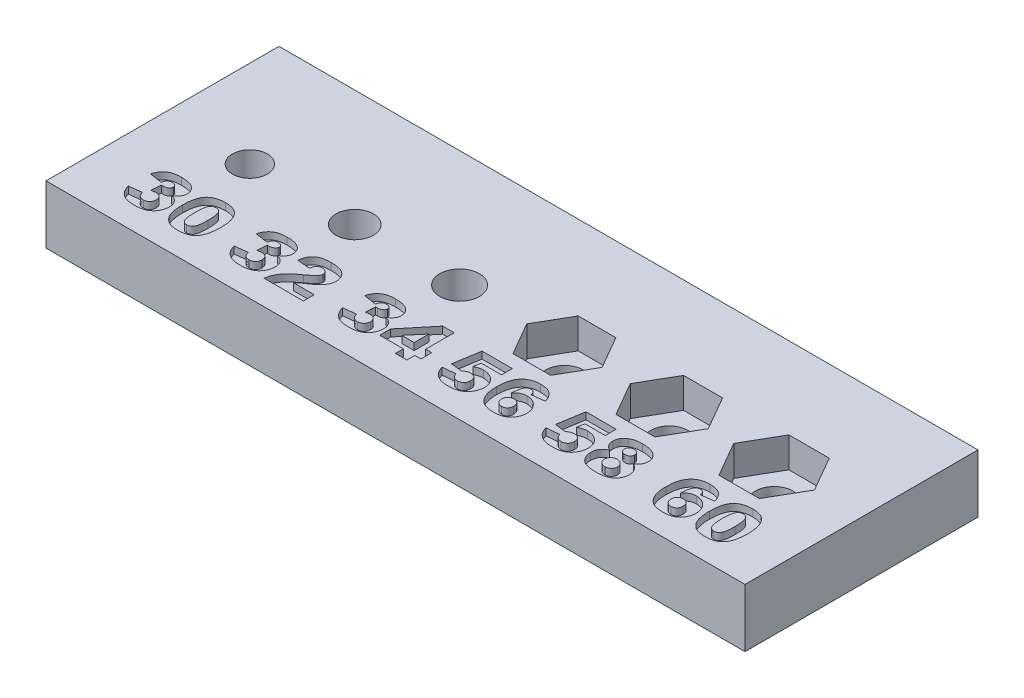
from build123d import *

# Parameters (mm, degrees)
SKETCH1_W           = 60
SKETCH1_H           = 20
BOSS_EXTRUDE2_DEPTH = 5
SKETCH2_R           = 1.5
SKETCH2_R_2         = 1.6
SKETCH2_R_3         = 1.7
CUT_EXTRUDE1_DEPTH  = 5
CUT_EXTRUDE2_DEPTH  = 2.6
CUT_EXTRUDE3_DEPTH  = 0.6


with BuildPart() as part:
    # Sketch1 → Boss-Extrude2 (new body)
    with BuildSketch(Plane(origin=(0, 0, 0), x_dir=(1, 0, 0), z_dir=(0, 1, 0))):
        with Locations((30, 10)):
            Rectangle(SKETCH1_W, SKETCH1_H)
    extrude(amount=-BOSS_EXTRUDE2_DEPTH)

    # Sketch2 → Cut-Extrude1 (cut)
    with BuildSketch(Plane(origin=(0, 0, 0), x_dir=(1, 0, 0), z_dir=(0, 1, 0))):
        with Locations(Location((7.5, 10, 0), (0, 0, 270))):
            Circle(SKETCH2_R)
        with Locations(Location((16.5, 10, 0), (0, 0, 270))):
            Circle(SKETCH2_R_2)
        with Locations(Location((25.5, 10, 0), (0, 0, 270))):
            Circle(SKETCH2_R_3)
        with Locations(Location((34.5, 10, 0), (0, 0, 270))):
            Circle(SKETCH2_R_2)
        with Locations(Location((43.5, 10, 0), (0, 0, 270))):
            Circle(SKETCH2_R_2)
        with Locations(Location((52.5, 10, 0), (0, 0, 270))):
            Circle(SKETCH2_R_2)
    extrude(amount=-CUT_EXTRUDE1_DEPTH, mode=Mode.SUBTRACT)

    # Sketch3 → Cut-Extrude2 (cut)
    with BuildSketch(Plane(origin=(0, 0, 0), x_dir=(1, 0, 0), z_dir=(0, 1, 0))):
        Polygon((37.733161507, 10), (36.116580754, 12.8), (32.883419246, 12.8), (31.266838493, 10), (32.883419246, 7.2), (36.116580754, 7.2), align=None)
        Polygon((46.848631561, 10), (45.174315781, 12.9), (41.825684219, 12.9), (40.151368439, 10), (41.825684219, 7.1), (45.174315781, 7.1), align=None)
        Polygon((55.964101615, 10), (54.232050808, 13), (50.767949192, 13), (49.035898385, 10), (50.767949192, 7), (54.232050808, 7), align=None)
    extrude(amount=-CUT_EXTRUDE2_DEPTH, mode=Mode.SUBTRACT)

    # Sketch4 → Cut-Extrude3 (cut)
    # profile 1 of 12: a face of its own
    with BuildSketch(Plane(origin=(0, 0, 0), x_dir=(1, 0, 0), z_dir=(0, 1, 0))):
        with BuildLine():
            Line((5.053397244, 4.838018849), (3.962488153, 5.002791576))
            add(Edge.make_bspline(
                [(3.962488153, 5.002791576), (3.973946992, 5.045493283), (3.996417776, 5.129231331), (4.041666071, 5.248711572), (4.093743116, 5.360939138), (4.153677115, 5.465549198), (4.221174418, 5.562641404), (4.296388147, 5.651560226), (4.378756689, 5.733287967), (4.469245885, 5.807600107), (4.568810269, 5.873851764), (4.678112073, 5.930448614), (4.796774993, 5.978779648), (4.925509646, 6.017120808), (5.063785412, 6.048122105), (5.211666745, 6.069539587), (5.369168298, 6.082832231), (5.477341023, 6.08411224), (5.533105036, 6.084772096)],
                knots=[0, 0, 0, 0, 1.016473964, 1.99330546, 2.934409827, 3.859992667, 4.762972884, 5.650703162, 6.535286226, 7.428605855, 8.340018839, 9.280937971, 10.255228319, 11.282957832, 12.367105901, 13.512225285, 14.717529764, 16, 16, 16, 16], degree=3))
            add(Edge.make_bspline(
                [(5.533105036, 6.084772096), (5.596717029, 6.084207502), (5.719505056, 6.083117685), (5.896696853, 6.068791985), (6.06015539, 6.04727889), (6.210480231, 6.017936829), (6.346763987, 5.97828467), (6.469838304, 5.930454823), (6.579473737, 5.873980053), (6.674998876, 5.807546725), (6.757769261, 5.734927052), (6.830330944, 5.658520582), (6.890223013, 5.576379615), (6.942039513, 5.491105911), (6.979371566, 5.399547637), (7.007733305, 5.304523132), (7.024064391, 5.204651042), (7.026290166, 5.136506954), (7.027423218, 5.10181755)],
                knots=[0, 0, 0, 0, 1.517383578, 2.928952978, 4.238160805, 5.44974818, 6.579458997, 7.619995139, 8.595949147, 9.514581533, 10.388460386, 11.219690946, 12.022770555, 12.809943427, 13.594039736, 14.374380097, 15.172462533, 16, 16, 16, 16], degree=3))
            add(Edge.make_bspline(
                [(7.027423218, 5.10181755), (7.0260618, 5.061349122), (7.023373373, 4.98143504), (6.995984394, 4.865259619), (6.953538695, 4.754491142), (6.892707886, 4.650083453), (6.814351619, 4.551907978), (6.719298419, 4.460006767), (6.607244683, 4.373894146), (6.523169418, 4.325161944), (6.479533608, 4.299869498)],
                knots=[0, 0, 0, 0, 0.947905039, 1.871853284, 2.784216614, 3.722702492, 4.694201726, 5.722124319, 6.817762277, 8, 8, 8, 8], degree=3))
            add(Edge.make_bspline(
                [(6.479533608, 4.299869498), (6.515150215, 4.290404694), (6.582711272, 4.272450929), (6.675633685, 4.238719214), (6.756680249, 4.205003074), (6.803401578, 4.176754028), (6.825312828, 4.163505862)],
                knots=[0, 0, 0, 0, 1.184343163, 2.246577671, 3.177684428, 4, 4, 4, 4], degree=3))
            add(Edge.make_bspline(
                [(6.825312828, 4.163505862), (6.856538103, 4.141873235), (6.918635614, 4.098852563), (6.999919388, 4.019912149), (7.070279954, 3.931363674), (7.130045083, 3.833468058), (7.177338234, 3.725400969), (7.2114722, 3.607329658), (7.231909668, 3.479423823), (7.234093014, 3.390855272), (7.235215426, 3.345324044)],
                knots=[0, 0, 0, 0, 0.951607881, 1.892456733, 2.829478787, 3.782803609, 4.761379966, 5.779454616, 6.858464331, 8, 8, 8, 8], degree=3))
            add(Edge.make_bspline(
                [(7.235215426, 3.345324044), (7.233106158, 3.286437368), (7.228889118, 3.168705751), (7.192235011, 2.994607072), (7.134013195, 2.824360282), (7.067617641, 2.687219274), (7.0034589, 2.582100074), (6.949814739, 2.507142046), (6.890871598, 2.437205217), (6.827960004, 2.370939064), (6.758201397, 2.311050335), (6.684190279, 2.254967942), (6.605548732, 2.202496375), (6.520517027, 2.156495961), (6.430206335, 2.114592052), (6.333069357, 2.07936259), (6.229801125, 2.047859867), (6.119119316, 2.024410867), (6.002191771, 2.004528997), (5.878299975, 1.991349957), (5.747813125, 1.981722223), (5.658394936, 1.98116239), (5.612650491, 1.980875992)],
                knots=[0, 0, 0, 0, 1.476279031, 2.951511793, 4.443628516, 5.983059138, 6.763175725, 7.531864904, 8.29332487, 9.056749507, 9.821862739, 10.597178928, 11.386137227, 12.191286903, 13.020603339, 13.881952483, 14.781925957, 15.727428807, 16.718531961, 17.756896181, 18.852475743, 20, 20, 20, 20], degree=3))
            add(Edge.make_bspline(
                [(5.612650491, 1.980875992), (5.568003975, 1.981471933), (5.481380983, 1.982628175), (5.354893722, 1.987876749), (5.235773272, 1.998564504), (5.12361991, 2.012943097), (5.018787861, 2.031599907), (4.921008594, 2.053844342), (4.830970654, 2.081772068), (4.720881578, 2.122288086), (4.594558034, 2.184944472), (4.456292032, 2.275669568), (4.331338451, 2.381135168), (4.221050958, 2.50351087), (4.124076463, 2.642007993), (4.039686541, 2.796504908), (3.967014329, 2.967058251), (3.929731414, 3.088174485), (3.910540101, 3.150518849)],
                knots=[0, 0, 0, 0, 0.94717577, 1.837706665, 2.684707542, 3.483469276, 4.235542299, 4.942784163, 5.609086716, 6.233823944, 7.429971554, 8.590460291, 9.734697625, 10.888696137, 12.075012856, 13.313165115, 14.61695657, 16, 16, 16, 16], degree=3))
            Line((3.910540101, 3.150518849), (5.001449192, 3.279577291))
            add(Edge.make_bspline(
                [(5.001449192, 3.279577291), (5.007394882, 3.255960114), (5.018898429, 3.210266297), (5.040110092, 3.145232193), (5.063420161, 3.085711741), (5.089627008, 3.032246652), (5.116758176, 2.983467311), (5.148269304, 2.941594559), (5.180076681, 2.90328884), (5.228658122, 2.862489328), (5.295164138, 2.820551603), (5.384938531, 2.785398238), (5.484218052, 2.76405348), (5.553826869, 2.761447914), (5.589923218, 2.760096771)],
                knots=[0, 0, 0, 0, 1.013482904, 1.960856885, 2.845504117, 3.671577595, 4.438490576, 5.163839406, 5.850378691, 6.505144346, 7.795649977, 9.104842238, 10.498686967, 12, 12, 12, 12], degree=3))
            add(Edge.make_bspline(
                [(5.589923218, 2.760096771), (5.627979265, 2.761939157), (5.702236246, 2.765534117), (5.808400608, 2.794394213), (5.90407886, 2.842924786), (5.988661625, 2.908346547), (6.058176535, 2.990664114), (6.108426154, 3.087075775), (6.139628344, 3.19596259), (6.1427059, 3.272864748), (6.144306335, 3.312856511)],
                knots=[0, 0, 0, 0, 1.039415399, 2.028162539, 2.98091851, 3.956040558, 4.932536472, 5.902030713, 6.90898391, 8, 8, 8, 8], degree=3))
            add(Edge.make_bspline(
                [(6.144306335, 3.312856511), (6.142505627, 3.353340785), (6.139074573, 3.430479223), (6.111280256, 3.539568767), (6.063889507, 3.634312653), (5.996357793, 3.71282429), (5.913301126, 3.774875421), (5.816298974, 3.820491082), (5.705408544, 3.846184748), (5.627394009, 3.849352527), (5.586676465, 3.851005862)],
                knots=[0, 0, 0, 0, 1.105816862, 2.107015386, 3.053219165, 3.976769062, 4.911831574, 5.868217612, 6.887374708, 8, 8, 8, 8], degree=3))
            add(Edge.make_bspline(
                [(5.586676465, 3.851005862), (5.561765224, 3.849947661), (5.507174207, 3.847628698), (5.418890326, 3.836959568), (5.318179557, 3.816424446), (5.247074109, 3.799790999), (5.2092414, 3.790940927)],
                knots=[0, 0, 0, 0, 0.781109365, 1.711739477, 2.782497035, 4, 4, 4, 4], degree=3))
            Line((5.2092414, 3.790940927), (5.26687127, 4.640778589))
            add(Edge.make_bspline(
                [(5.26687127, 4.640778589), (5.294978634, 4.637609571), (5.344085256, 4.632072951), (5.393477252, 4.630779678), (5.414598543, 4.630226641)],
                knots=[0, 0, 0, 0, 1.144748428, 2, 2, 2, 2], degree=3))
            add(Edge.make_bspline(
                [(5.414598543, 4.630226641), (5.450417856, 4.631301109), (5.519438419, 4.63337151), (5.618392606, 4.654098788), (5.708046394, 4.688391016), (5.787062513, 4.73503713), (5.852929768, 4.790523027), (5.900638515, 4.853778659), (5.931868514, 4.922173645), (5.934968334, 4.970550505), (5.936514127, 4.994674693)],
                knots=[0, 0, 0, 0, 1.222475891, 2.355599977, 3.435433984, 4.488139095, 5.477788772, 6.355989587, 7.180177952, 8, 8, 8, 8], degree=3))
            add(Edge.make_bspline(
                [(5.936514127, 4.994674693), (5.935438879, 5.017300576), (5.933356414, 5.0611208), (5.912145209, 5.123124019), (5.877019754, 5.177181387), (5.828835295, 5.222823171), (5.769842599, 5.260561966), (5.699482499, 5.287352737), (5.618953598, 5.302236239), (5.562117915, 5.304410416), (5.532293348, 5.305551317)],
                knots=[0, 0, 0, 0, 0.944636713, 1.829506197, 2.706215999, 3.619562109, 4.587483607, 5.620444109, 6.75132628, 8, 8, 8, 8], degree=3))
            add(Edge.make_bspline(
                [(5.532293348, 5.305551317), (5.50161778, 5.304383174), (5.442303962, 5.30212447), (5.357735821, 5.282593822), (5.28222879, 5.249342031), (5.214311804, 5.203710925), (5.15752956, 5.13879949), (5.111328683, 5.055927747), (5.076243096, 4.953507364), (5.061363821, 4.87829085), (5.053397244, 4.838018849)],
                knots=[0, 0, 0, 0, 0.988061552, 1.910501065, 2.777503571, 3.636395657, 4.525876446, 5.529824988, 6.677432876, 8, 8, 8, 8], degree=3))
        make_face()
    # profile 2 of 12: a face of its own
    with BuildSketch(Plane(origin=(0, 0, 0), x_dir=(1, 0, 0), z_dir=(0, 1, 0))):
        with BuildLine():
            add(Edge.make_bspline(
                [(7.650799841, 4.04905781), (7.651097494, 4.095328529), (7.651680787, 4.186002496), (7.656669676, 4.319436055), (7.664686814, 4.447735658), (7.675959673, 4.570905464), (7.690446696, 4.688685155), (7.708428264, 4.801012321), (7.729011348, 4.908150157), (7.754573268, 5.009486944), (7.782147637, 5.105962773), (7.812492738, 5.197173697), (7.846877917, 5.282986237), (7.884261153, 5.36345663), (7.924436637, 5.439275642), (7.969352271, 5.508810636), (8.016538485, 5.573538548), (8.083776115, 5.652624531), (8.177404434, 5.741776075), (8.303419195, 5.834294431), (8.443824173, 5.911340881), (8.59684763, 5.975687368), (8.763724067, 6.02515371), (8.944026579, 6.059341066), (9.137839034, 6.080766529), (9.271682821, 6.083408871), (9.340734906, 6.084772096)],
                knots=[0, 0, 0, 0, 1.087591881, 2.13128891, 3.138140209, 4.108914138, 5.038156313, 5.926884649, 6.782501702, 7.601552758, 8.382534381, 9.140733058, 9.859947563, 10.554209912, 11.225728598, 11.87495301, 12.498241101, 13.107351257, 14.312855526, 15.527634648, 16.771709977, 18.068615969, 19.42276522, 20.854627635, 22.377253613, 24, 24, 24, 24], degree=3))
            add(Edge.make_bspline(
                [(9.340734906, 6.084772096), (9.406244223, 6.083454816), (9.531302612, 6.080940106), (9.70991, 6.064070837), (9.869907379, 6.032390546), (10.012578585, 5.989364004), (10.139677702, 5.935894828), (10.253823146, 5.875016616), (10.356146317, 5.80686346), (10.445638853, 5.730774295), (10.523951355, 5.650046782), (10.594328222, 5.567721374), (10.656250608, 5.483701764), (10.709026025, 5.395973126), (10.754657405, 5.303655676), (10.796395249, 5.205542637), (10.831818208, 5.099467453), (10.851664601, 5.025896923), (10.861838802, 4.988181187)],
                knots=[0, 0, 0, 0, 1.532758214, 2.92606128, 4.191114603, 5.342542327, 6.406514669, 7.411909621, 8.365259272, 9.277101494, 10.154475564, 10.994207034, 11.809606612, 12.593434151, 13.38610729, 14.217325278, 15.086116559, 16, 16, 16, 16], degree=3))
            add(Edge.make_bspline(
                [(10.861838802, 4.988181187), (10.879332092, 4.913704612), (10.914488949, 4.76402651), (10.949458723, 4.534522204), (10.971175227, 4.300293608), (10.97403374, 4.142450188), (10.975475166, 4.062856511)],
                knots=[0, 0, 0, 0, 0.98198754, 1.973533715, 2.978139842, 4, 4, 4, 4], degree=3))
            add(Edge.make_bspline(
                [(10.975475166, 4.062856511), (10.974548383, 3.975700406), (10.972758894, 3.807414023), (10.954489505, 3.564104623), (10.925956589, 3.339058561), (10.885702395, 3.131690025), (10.833654258, 2.942169492), (10.768632748, 2.770684202), (10.692659597, 2.617117717), (10.60423839, 2.48061911), (10.500948868, 2.361205331), (10.380617551, 2.25828851), (10.242929579, 2.172361598), (10.088952842, 2.101218333), (9.91779782, 2.047357367), (9.730394168, 2.009025644), (9.526137199, 1.985214054), (9.384364009, 1.982359265), (9.310702439, 1.980875992)],
                knots=[0, 0, 0, 0, 1.355222045, 2.616746286, 3.792100794, 4.881385083, 5.899230633, 6.844809326, 7.729242134, 8.559026746, 9.367323913, 10.17605905, 11.01191325, 11.883571865, 12.807079121, 13.795717036, 14.854713345, 16, 16, 16, 16], degree=3))
            add(Edge.make_bspline(
                [(9.310702439, 1.980875992), (9.269027803, 1.981349518), (9.187505907, 1.982275806), (9.067992854, 1.989332739), (8.954874111, 2.002658111), (8.847659182, 2.019123431), (8.746913963, 2.042111889), (8.651935018, 2.069422755), (8.563147307, 2.101800351), (8.453980595, 2.151620687), (8.327438184, 2.226476587), (8.190313115, 2.335794284), (8.065374272, 2.462232269), (7.996617803, 2.559627487), (7.961676465, 2.609122745)],
                knots=[0, 0, 0, 0, 0.962031703, 1.881879664, 2.761979937, 3.590622586, 4.384597812, 5.1455833, 5.870765821, 6.563934203, 7.913599601, 9.251901546, 10.603444349, 12, 12, 12, 12], degree=3))
            add(Edge.make_bspline(
                [(7.961676465, 2.609122745), (7.937749981, 2.648401433), (7.887198414, 2.731388938), (7.827144453, 2.872566373), (7.774546597, 3.033199722), (7.72971322, 3.21193898), (7.694936429, 3.406194258), (7.668939249, 3.611797574), (7.653290732, 3.827221839), (7.651641668, 3.974085607), (7.650799841, 4.04905781)],
                knots=[0, 0, 0, 0, 0.739508101, 1.562423156, 2.461722298, 3.458822943, 4.525732562, 5.636331831, 6.793375565, 8, 8, 8, 8], degree=3))
        make_face()
        with BuildLine():
            add(Edge.make_bspline(
                [(8.741708932, 4.036882485), (8.74221307, 3.977893956), (8.743180045, 3.864749361), (8.749445264, 3.702309328), (8.760437702, 3.55442414), (8.776678928, 3.421209008), (8.796387603, 3.302079921), (8.82130256, 3.197654751), (8.849791827, 3.107293136), (8.884501094, 3.03135491), (8.922916395, 2.966570197), (8.966447979, 2.912106273), (9.012912737, 2.864718273), (9.064179376, 2.826565775), (9.119645294, 2.796550801), (9.179144583, 2.775836953), (9.24269931, 2.761971701), (9.286545467, 2.760733244), (9.309079062, 2.760096771)],
                knots=[0, 0, 0, 0, 1.821909252, 3.494563902, 5.019956466, 6.400590685, 7.638410235, 8.747100251, 9.714301165, 10.559433052, 11.320433586, 12.034323191, 12.707949409, 13.364779561, 14.000375056, 14.647943435, 15.305145593, 16, 16, 16, 16], degree=3))
            add(Edge.make_bspline(
                [(9.309079062, 2.760096771), (9.338424833, 2.761513973), (9.396011182, 2.764295004), (9.47931397, 2.785868687), (9.556243436, 2.822438528), (9.627005301, 2.87347191), (9.690380237, 2.940358408), (9.744025591, 3.02435843), (9.789275609, 3.124064636), (9.818210225, 3.219291861), (9.836855418, 3.305522473), (9.849748732, 3.380546913), (9.861095452, 3.463904158), (9.869922983, 3.555967892), (9.876102641, 3.656689653), (9.880868672, 3.766014881), (9.88437498, 3.883992204), (9.884500851, 3.965451116), (9.884566075, 4.007661706)],
                knots=[0, 0, 0, 0, 0.916415337, 1.79831749, 2.668301498, 3.564798814, 4.509831996, 5.530070663, 6.665194469, 7.922271743, 8.632174375, 9.421805176, 10.300783619, 11.260830182, 12.3115562, 13.454245384, 14.680834273, 16, 16, 16, 16], degree=3))
            add(Edge.make_bspline(
                [(9.884566075, 4.007661706), (9.884060496, 4.069084968), (9.883091354, 4.186827034), (9.876866163, 4.355488764), (9.865848989, 4.508509944), (9.849670892, 4.645519795), (9.830063111, 4.767108255), (9.804931445, 4.872855101), (9.776672537, 4.96352777), (9.742262207, 5.039414326), (9.701819645, 5.102196975), (9.659402671, 5.157425192), (9.610764979, 5.203022714), (9.558580898, 5.241372802), (9.500593209, 5.269609718), (9.438869814, 5.291090299), (9.372058606, 5.303346533), (9.326173288, 5.304802741), (9.302585556, 5.305551317)],
                knots=[0, 0, 0, 0, 1.854070858, 3.554062822, 5.093710173, 6.483564629, 7.717457497, 8.808936618, 9.761959363, 10.58049486, 11.31461684, 12.012310019, 12.676654168, 13.320346403, 13.959515242, 14.615524135, 15.288298562, 16, 16, 16, 16], degree=3))
            add(Edge.make_bspline(
                [(9.302585556, 5.305551317), (9.278711465, 5.304888852), (9.23220803, 5.303598461), (9.16527879, 5.290220533), (9.103519914, 5.269004445), (9.046560698, 5.239601234), (8.995229112, 5.200760961), (8.948215732, 5.154197873), (8.90791259, 5.098059111), (8.871293569, 5.033577643), (8.840611811, 4.95734094), (8.813931203, 4.867944393), (8.791968569, 4.764445191), (8.773279375, 4.646597877), (8.759199074, 4.514651944), (8.748519597, 4.368206284), (8.743442708, 4.207372154), (8.742303271, 4.095326383), (8.741708932, 4.036882485)],
                knots=[0, 0, 0, 0, 0.737997139, 1.437516644, 2.102141925, 2.753771676, 3.411878008, 4.086813041, 4.793511383, 5.543335322, 6.376757621, 7.330304624, 8.427368638, 9.648338126, 11.021405169, 12.532439492, 14.191294945, 16, 16, 16, 16], degree=3))
        make_face(mode=Mode.SUBTRACT)
    # profile 3 of 12: a face of its own
    with BuildSketch(Plane(origin=(0, 0, 0), x_dir=(1, 0, 0), z_dir=(0, 1, 0))):
        with BuildLine():
            Line((14.053559267, 4.922346458), (12.962650176, 5.087119185))
            add(Edge.make_bspline(
                [(12.962650176, 5.087119185), (12.974109015, 5.129820892), (12.996579799, 5.21355894), (13.041828094, 5.333039181), (13.093905138, 5.445266746), (13.153839138, 5.549876807), (13.221336441, 5.646969012), (13.29655017, 5.735887835), (13.378918711, 5.817615576), (13.469407907, 5.891927716), (13.568972292, 5.958179373), (13.678274096, 6.014776223), (13.796937015, 6.063107257), (13.925671668, 6.101448417), (14.063947435, 6.132449714), (14.211828768, 6.153867195), (14.36933032, 6.16715984), (14.477503046, 6.168439849), (14.533267059, 6.169099705)],
                knots=[0, 0, 0, 0, 1.016473964, 1.99330546, 2.934409827, 3.859992667, 4.762972884, 5.650703162, 6.535286226, 7.428605855, 8.340018839, 9.280937971, 10.255228319, 11.282957832, 12.367105901, 13.512225285, 14.717529764, 16, 16, 16, 16], degree=3))
            add(Edge.make_bspline(
                [(14.533267059, 6.169099705), (14.596879052, 6.16853511), (14.719667079, 6.167445293), (14.896858876, 6.153119593), (15.060317413, 6.131606499), (15.210642254, 6.102264437), (15.34692601, 6.062612279), (15.470000327, 6.014782432), (15.579635759, 5.958307662), (15.675160899, 5.891874334), (15.757931283, 5.819254661), (15.830492967, 5.74284819), (15.890385035, 5.660707224), (15.942201536, 5.57543352), (15.979533589, 5.483875245), (16.007895328, 5.388850741), (16.024226414, 5.28897865), (16.026452188, 5.220834563), (16.027585241, 5.186145159)],
                knots=[0, 0, 0, 0, 1.517383578, 2.928952978, 4.238160805, 5.44974818, 6.579458997, 7.619995139, 8.595949147, 9.514581533, 10.388460386, 11.219690946, 12.022770555, 12.809943427, 13.594039736, 14.374380097, 15.172462533, 16, 16, 16, 16], degree=3))
            add(Edge.make_bspline(
                [(16.027585241, 5.186145159), (16.026223823, 5.14567673), (16.023535395, 5.065762648), (15.996146417, 4.949587228), (15.953700718, 4.838818751), (15.892869909, 4.734411062), (15.814513641, 4.636235587), (15.719460442, 4.544334375), (15.607406706, 4.458221755), (15.52333144, 4.409489553), (15.47969563, 4.384197107)],
                knots=[0, 0, 0, 0, 0.947905039, 1.871853284, 2.784216614, 3.722702492, 4.694201726, 5.722124319, 6.817762277, 8, 8, 8, 8], degree=3))
            add(Edge.make_bspline(
                [(15.47969563, 4.384197107), (15.515312238, 4.374732302), (15.582873295, 4.356778537), (15.675795708, 4.323046823), (15.756842272, 4.289330683), (15.8035636, 4.261081637), (15.825474851, 4.247833471)],
                knots=[0, 0, 0, 0, 1.184343163, 2.246577671, 3.177684428, 4, 4, 4, 4], degree=3))
            add(Edge.make_bspline(
                [(15.825474851, 4.247833471), (15.856700126, 4.226200844), (15.918797637, 4.183180171), (16.000081411, 4.104239757), (16.070441976, 4.015691283), (16.130207106, 3.917795666), (16.177500256, 3.809728578), (16.211634222, 3.691657267), (16.232071691, 3.563751432), (16.234255036, 3.475182881), (16.235377448, 3.429651653)],
                knots=[0, 0, 0, 0, 0.951607881, 1.892456733, 2.829478787, 3.782803609, 4.761379966, 5.779454616, 6.858464331, 8, 8, 8, 8], degree=3))
            add(Edge.make_bspline(
                [(16.235377448, 3.429651653), (16.233268181, 3.370764977), (16.22905114, 3.25303336), (16.192397034, 3.07893468), (16.134175217, 2.90868789), (16.067779664, 2.771546883), (16.003620923, 2.666427682), (15.949976762, 2.591469655), (15.891033621, 2.521532825), (15.828122027, 2.455266673), (15.75836342, 2.395377944), (15.684352302, 2.339295551), (15.605710754, 2.286823984), (15.52067905, 2.240823569), (15.430368357, 2.198919661), (15.33323138, 2.163690199), (15.229963147, 2.132187476), (15.119281338, 2.108738476), (15.002353794, 2.088856606), (14.878461998, 2.075677566), (14.747975147, 2.066049831), (14.658556959, 2.065489999), (14.612812513, 2.065203601)],
                knots=[0, 0, 0, 0, 1.476279031, 2.951511793, 4.443628516, 5.983059138, 6.763175725, 7.531864904, 8.29332487, 9.056749507, 9.821862739, 10.597178928, 11.386137227, 12.191286903, 13.020603339, 13.881952483, 14.781925957, 15.727428807, 16.718531961, 17.756896181, 18.852475743, 20, 20, 20, 20], degree=3))
            add(Edge.make_bspline(
                [(14.612812513, 2.065203601), (14.568165998, 2.065799541), (14.481543006, 2.066955783), (14.355055744, 2.072204357), (14.235935294, 2.082892113), (14.123781932, 2.097270706), (14.018949884, 2.115927516), (13.921170617, 2.138171951), (13.831132677, 2.166099677), (13.721043601, 2.206615695), (13.594720057, 2.269272081), (13.456454055, 2.359997177), (13.331500473, 2.465462777), (13.221212981, 2.587838479), (13.124238485, 2.726335601), (13.039848564, 2.880832516), (12.967176352, 3.051385859), (12.929893437, 3.172502094), (12.910702124, 3.234846458)],
                knots=[0, 0, 0, 0, 0.94717577, 1.837706665, 2.684707542, 3.483469276, 4.235542299, 4.942784163, 5.609086716, 6.233823944, 7.429971554, 8.590460291, 9.734697625, 10.888696137, 12.075012856, 13.313165115, 14.61695657, 16, 16, 16, 16], degree=3))
            Line((12.910702124, 3.234846458), (14.001611215, 3.363904899))
            add(Edge.make_bspline(
                [(14.001611215, 3.363904899), (14.007556905, 3.340287723), (14.019060451, 3.294593905), (14.040272114, 3.229559802), (14.063582183, 3.17003935), (14.08978903, 3.116574261), (14.116920199, 3.06779492), (14.148431327, 3.025922168), (14.180238704, 2.987616448), (14.228820144, 2.946816937), (14.295326161, 2.904879212), (14.385100554, 2.869725847), (14.484380075, 2.848381088), (14.553988892, 2.845775522), (14.590085241, 2.84442438)],
                knots=[0, 0, 0, 0, 1.013482904, 1.960856885, 2.845504117, 3.671577595, 4.438490576, 5.163839406, 5.850378691, 6.505144346, 7.795649977, 9.104842238, 10.498686967, 12, 12, 12, 12], degree=3))
            add(Edge.make_bspline(
                [(14.590085241, 2.84442438), (14.628141288, 2.846266765), (14.702398269, 2.849861726), (14.808562631, 2.878721821), (14.904240883, 2.927252394), (14.988823648, 2.992674156), (15.058338557, 3.074991722), (15.108588177, 3.171403384), (15.139790367, 3.280290198), (15.142867923, 3.357192357), (15.144468358, 3.39718412)],
                knots=[0, 0, 0, 0, 1.039415399, 2.028162539, 2.98091851, 3.956040558, 4.932536472, 5.902030713, 6.90898391, 8, 8, 8, 8], degree=3))
            add(Edge.make_bspline(
                [(15.144468358, 3.39718412), (15.14266765, 3.437668393), (15.139236596, 3.514806832), (15.111442279, 3.623896376), (15.06405153, 3.718640262), (14.996519816, 3.797151899), (14.913463149, 3.85920303), (14.816460997, 3.904818691), (14.705570567, 3.930512357), (14.627556032, 3.933680136), (14.586838487, 3.935333471)],
                knots=[0, 0, 0, 0, 1.105816862, 2.107015386, 3.053219165, 3.976769062, 4.911831574, 5.868217612, 6.887374708, 8, 8, 8, 8], degree=3))
            add(Edge.make_bspline(
                [(14.586838487, 3.935333471), (14.561927247, 3.93427527), (14.50733623, 3.931956306), (14.419052349, 3.921287177), (14.31834158, 3.900752055), (14.247236131, 3.884118608), (14.209403422, 3.875268536)],
                knots=[0, 0, 0, 0, 0.781109365, 1.711739477, 2.782497035, 4, 4, 4, 4], degree=3))
            Line((14.209403422, 3.875268536), (14.267033293, 4.725106198))
            add(Edge.make_bspline(
                [(14.267033293, 4.725106198), (14.295140657, 4.72193718), (14.344247279, 4.71640056), (14.393639274, 4.715107287), (14.414760565, 4.71455425)],
                knots=[0, 0, 0, 0, 1.144748428, 2, 2, 2, 2], degree=3))
            add(Edge.make_bspline(
                [(14.414760565, 4.71455425), (14.450579879, 4.715628717), (14.519600442, 4.717699118), (14.618554629, 4.738426397), (14.708208417, 4.772718625), (14.787224535, 4.819364738), (14.85309179, 4.874850636), (14.900800537, 4.938106268), (14.932030536, 5.006501254), (14.935130356, 5.054878114), (14.93667615, 5.079002302)],
                knots=[0, 0, 0, 0, 1.222475891, 2.355599977, 3.435433984, 4.488139095, 5.477788772, 6.355989587, 7.180177952, 8, 8, 8, 8], degree=3))
            add(Edge.make_bspline(
                [(14.93667615, 5.079002302), (14.935600902, 5.101628185), (14.933518437, 5.145448409), (14.912307232, 5.207451628), (14.877181777, 5.261508996), (14.828997318, 5.30715078), (14.770004622, 5.344889575), (14.699644522, 5.371680346), (14.619115621, 5.386563847), (14.562279938, 5.388738024), (14.532455371, 5.389878925)],
                knots=[0, 0, 0, 0, 0.944636713, 1.829506197, 2.706215999, 3.619562109, 4.587483607, 5.620444109, 6.75132628, 8, 8, 8, 8], degree=3))
            add(Edge.make_bspline(
                [(14.532455371, 5.389878925), (14.501779803, 5.388710783), (14.442465984, 5.386452079), (14.357897844, 5.366921431), (14.282390813, 5.33366964), (14.214473827, 5.288038534), (14.157691583, 5.223127098), (14.111490706, 5.140255356), (14.076405119, 5.037834973), (14.061525844, 4.962618458), (14.053559267, 4.922346458)],
                knots=[0, 0, 0, 0, 0.988061552, 1.910501065, 2.777503571, 3.636395657, 4.525876446, 5.529824988, 6.677432876, 8, 8, 8, 8], degree=3))
        make_face()
    # profile 4 of 12: a face of its own
    with BuildSketch(Plane(origin=(0, 0, 0), x_dir=(1, 0, 0), z_dir=(0, 1, 0))):
        with BuildLine():
            Line((19.975637189, 2.117151653), (16.599013812, 2.117151653))
            add(Edge.make_bspline(
                [(16.599013812, 2.117151653), (16.604337044, 2.158654108), (16.614942243, 2.241337294), (16.642104803, 2.363542195), (16.674022193, 2.48432273), (16.71365524, 2.603293797), (16.762548716, 2.719481429), (16.816061533, 2.835113288), (16.879557932, 2.947602461), (16.948628493, 3.061030114), (17.031668488, 3.174260418), (17.128375088, 3.291606946), (17.242602337, 3.411860106), (17.371890737, 3.536834036), (17.516710679, 3.666051755), (17.678012502, 3.798898982), (17.85471315, 3.937099057), (17.979940564, 4.027990861), (18.044630695, 4.07494386)],
                knots=[0, 0, 0, 0, 0.798125275, 1.590063504, 2.386650706, 3.181830982, 3.980573995, 4.791293479, 5.611770483, 6.444247553, 7.324209591, 8.288770749, 9.344442884, 10.487375082, 11.719741268, 13.047247144, 14.47466329, 16, 16, 16, 16], degree=3))
            add(Edge.make_bspline(
                [(18.044630695, 4.07494386), (18.083983951, 4.103186117), (18.159431845, 4.157332052), (18.265977467, 4.237824672), (18.361582164, 4.313625434), (18.447612106, 4.382493146), (18.522034032, 4.44727681), (18.585940381, 4.506243559), (18.640178328, 4.559340729), (18.695050852, 4.622978297), (18.749018197, 4.697569462), (18.796343861, 4.786360528), (18.827496022, 4.873211521), (18.831063142, 4.931587137), (18.832780046, 4.95968412)],
                knots=[0, 0, 0, 0, 1.426735716, 2.735331656, 3.932690034, 5.020515582, 5.980894753, 6.838122453, 7.581977732, 8.214735694, 9.311631457, 10.284853698, 11.17447662, 12, 12, 12, 12], degree=3))
            add(Edge.make_bspline(
                [(18.832780046, 4.95968412), (18.831113743, 4.98857837), (18.827850359, 5.045166527), (18.80029379, 5.126500794), (18.755614422, 5.200544652), (18.694172536, 5.266046154), (18.620289266, 5.320748848), (18.535681856, 5.361620056), (18.441473249, 5.385384422), (18.375664696, 5.388349168), (18.341708617, 5.389878925)],
                knots=[0, 0, 0, 0, 0.952945949, 1.866303995, 2.804834556, 3.791947944, 4.814941972, 5.826815529, 6.878674284, 8, 8, 8, 8], degree=3))
            add(Edge.make_bspline(
                [(18.341708617, 5.389878925), (18.306396019, 5.388392029), (18.238436815, 5.385530492), (18.141360518, 5.361552965), (18.05477548, 5.321355835), (17.991291186, 5.274678714), (17.94653762, 5.229009706), (17.915545299, 5.188211953), (17.888633994, 5.140821545), (17.862655291, 5.088342823), (17.841494352, 5.029350128), (17.822751685, 4.964514631), (17.806507718, 4.893776981), (17.798157053, 4.844203196), (17.793819007, 4.818450354)],
                knots=[0, 0, 0, 0, 1.439477229, 2.770278312, 4.04952311, 5.312562752, 5.960562671, 6.653906719, 7.396155607, 8.18125893, 9.040559249, 9.948954118, 10.934512264, 12, 12, 12, 12], degree=3))
            Line((17.793819007, 4.818450354), (16.702909916, 4.903677627))
            add(Edge.make_bspline(
                [(16.702909916, 4.903677627), (16.708475605, 4.941353992), (16.719369804, 5.015101159), (16.741758558, 5.121600073), (16.765654379, 5.222323728), (16.794130238, 5.316272132), (16.825725821, 5.404091204), (16.860311308, 5.485751028), (16.899577774, 5.560218868), (16.954589055, 5.651954856), (17.036024256, 5.755192788), (17.151443726, 5.864056865), (17.284966962, 5.956556548), (17.409239378, 6.020827669), (17.518643939, 6.063729961), (17.609851511, 6.091889616), (17.708480051, 6.116155232), (17.814794553, 6.135357306), (17.928503938, 6.150960833), (18.050169849, 6.160961978), (18.17929669, 6.167643425), (18.267835918, 6.168605628), (18.313299526, 6.169099705)],
                knots=[0, 0, 0, 0, 0.989592556, 1.937013979, 2.827284947, 3.679299113, 4.486736888, 5.252174584, 5.981861435, 6.672880631, 8.030317246, 9.383357337, 10.782057359, 12.238191716, 13.008619595, 13.833745451, 14.717186414, 15.646773357, 16.640255679, 17.698985578, 18.818462498, 20, 20, 20, 20], degree=3))
            add(Edge.make_bspline(
                [(18.313299526, 6.169099705), (18.360650963, 6.168493124), (18.452951931, 6.167310733), (18.58728483, 6.162185316), (18.713700001, 6.151376401), (18.831807933, 6.137111269), (18.941815185, 6.118537407), (19.043683702, 6.095778445), (19.137666632, 6.069531627), (19.223988113, 6.038091042), (19.304193514, 6.003262646), (19.379250673, 5.963172723), (19.449787375, 5.918669929), (19.515786249, 5.869600576), (19.577967122, 5.81678998), (19.635379346, 5.758903157), (19.6894522, 5.697294483), (19.73776606, 5.630659039), (19.781320456, 5.561194845), (19.820133671, 5.489674764), (19.851147943, 5.415338817), (19.878933502, 5.339600192), (19.898417187, 5.261113167), (19.913664297, 5.180967476), (19.921411199, 5.09863406), (19.92292349, 5.043030196), (19.923689137, 5.014878925)],
                knots=[0, 0, 0, 0, 1.520214409, 2.96331587, 4.314320473, 5.592028486, 6.781488773, 7.894101563, 8.941615604, 9.911497389, 10.841025698, 11.746378512, 12.640369159, 13.515899531, 14.384509289, 15.256629472, 16.130909547, 17.01343449, 17.895446386, 18.761969182, 19.621893716, 20.479006308, 21.349047949, 22.214481793, 23.096023134, 24, 24, 24, 24], degree=3))
            add(Edge.make_bspline(
                [(19.923689137, 5.014878925), (19.923159016, 4.984809614), (19.922100237, 4.924753975), (19.910638542, 4.835622788), (19.894916969, 4.747280058), (19.871127464, 4.660157138), (19.840022165, 4.574051541), (19.802562314, 4.488654301), (19.758768732, 4.404246113), (19.707677376, 4.320362967), (19.648300799, 4.235870035), (19.576327697, 4.15168441), (19.495843136, 4.063997612), (19.403062745, 3.975241627), (19.299677752, 3.884686972), (19.184170564, 3.7933461), (19.059911122, 3.697710422), (18.971062372, 3.636496503), (18.925312513, 3.604976328)],
                knots=[0, 0, 0, 0, 0.799860441, 1.597513472, 2.388474526, 3.186809909, 3.997713199, 4.82322568, 5.667097207, 6.52667738, 7.43580813, 8.412238442, 9.472172286, 10.602795499, 11.827605265, 13.128826161, 14.521579684, 16, 16, 16, 16], degree=3))
            add(Edge.make_bspline(
                [(18.925312513, 3.604976328), (18.898217673, 3.586905722), (18.846336729, 3.552304295), (18.772711235, 3.501897183), (18.705809597, 3.456278797), (18.645508746, 3.414948449), (18.592501902, 3.377289666), (18.546920193, 3.343443404), (18.507382921, 3.315265406), (18.463756129, 3.281213812), (18.411747216, 3.238236406), (18.347401666, 3.182693231), (18.277672952, 3.120664548), (18.230632295, 3.075642115), (18.206156669, 3.052216588)],
                knots=[0, 0, 0, 0, 1.290297726, 2.470649887, 3.535060469, 4.498436346, 5.366972879, 6.11094909, 6.74773956, 7.290209297, 8.303122279, 9.420462908, 10.657846448, 12, 12, 12, 12], degree=3))
            Line((18.206156669, 3.052216588), (19.975637189, 3.052216588))
            Line((19.975637189, 3.052216588), (19.975637189, 2.117151653))
        make_face()
    # profile 5 of 12: a face of its own
    with BuildSketch(Plane(origin=(0, 0, 0), x_dir=(1, 0, 0), z_dir=(0, 1, 0))):
        with BuildLine():
            Line((23.302169118, 4.978060975), (22.211260027, 5.142833702))
            add(Edge.make_bspline(
                [(22.211260027, 5.142833702), (22.222718866, 5.185535409), (22.24518965, 5.269273457), (22.290437945, 5.388753698), (22.342514989, 5.500981264), (22.402448989, 5.605591324), (22.469946292, 5.70268353), (22.545160021, 5.791602352), (22.627528563, 5.873330093), (22.718017758, 5.947642233), (22.817582143, 6.01389389), (22.926883947, 6.07049074), (23.045546866, 6.118821774), (23.17428152, 6.157162934), (23.312557286, 6.188164231), (23.460438619, 6.209581712), (23.617940171, 6.222874357), (23.726112897, 6.224154366), (23.78187691, 6.224814222)],
                knots=[0, 0, 0, 0, 1.016473964, 1.99330546, 2.934409827, 3.859992667, 4.762972884, 5.650703162, 6.535286226, 7.428605855, 8.340018839, 9.280937971, 10.255228319, 11.282957832, 12.367105901, 13.512225285, 14.717529764, 16, 16, 16, 16], degree=3))
            add(Edge.make_bspline(
                [(23.78187691, 6.224814222), (23.845488903, 6.224249627), (23.96827693, 6.223159811), (24.145468727, 6.208834111), (24.308927264, 6.187321016), (24.459252105, 6.157978954), (24.595535861, 6.118326796), (24.718610178, 6.070496949), (24.82824561, 6.014022179), (24.92377075, 5.947588851), (25.006541135, 5.874969178), (25.079102818, 5.798562708), (25.138994886, 5.716421741), (25.190811387, 5.631148037), (25.22814344, 5.539589763), (25.256505179, 5.444565258), (25.272836265, 5.344693167), (25.27506204, 5.27654908), (25.276195092, 5.241859676)],
                knots=[0, 0, 0, 0, 1.517383578, 2.928952978, 4.238160805, 5.44974818, 6.579458997, 7.619995139, 8.595949147, 9.514581533, 10.388460386, 11.219690946, 12.022770555, 12.809943427, 13.594039736, 14.374380097, 15.172462533, 16, 16, 16, 16], degree=3))
            add(Edge.make_bspline(
                [(25.276195092, 5.241859676), (25.274833674, 5.201391248), (25.272145246, 5.121477166), (25.244756268, 5.005301745), (25.202310569, 4.894533268), (25.14147976, 4.790125579), (25.063123493, 4.691950104), (24.968070293, 4.600048893), (24.856016557, 4.513936272), (24.771941292, 4.46520407), (24.728305481, 4.439911624)],
                knots=[0, 0, 0, 0, 0.947905039, 1.871853284, 2.784216614, 3.722702492, 4.694201726, 5.722124319, 6.817762277, 8, 8, 8, 8], degree=3))
            add(Edge.make_bspline(
                [(24.728305481, 4.439911624), (24.763922089, 4.43044682), (24.831483146, 4.412493055), (24.924405559, 4.37876134), (25.005452123, 4.3450452), (25.052173451, 4.316796154), (25.074084702, 4.303547988)],
                knots=[0, 0, 0, 0, 1.184343163, 2.246577671, 3.177684428, 4, 4, 4, 4], degree=3))
            add(Edge.make_bspline(
                [(25.074084702, 4.303547988), (25.105309977, 4.281915361), (25.167407488, 4.238894688), (25.248691262, 4.159954274), (25.319051827, 4.0714058), (25.378816957, 3.973510184), (25.426110107, 3.865443095), (25.460244074, 3.747371784), (25.480681542, 3.619465949), (25.482864888, 3.530897398), (25.4839873, 3.48536617)],
                knots=[0, 0, 0, 0, 0.951607881, 1.892456733, 2.829478787, 3.782803609, 4.761379966, 5.779454616, 6.858464331, 8, 8, 8, 8], degree=3))
            add(Edge.make_bspline(
                [(25.4839873, 3.48536617), (25.481878032, 3.426479494), (25.477660992, 3.308747877), (25.441006885, 3.134649197), (25.382785069, 2.964402408), (25.316389515, 2.8272614), (25.252230774, 2.7221422), (25.198586613, 2.647184172), (25.139643472, 2.577247342), (25.076731878, 2.51098119), (25.006973271, 2.451092461), (24.932962153, 2.395010068), (24.854320605, 2.342538501), (24.769288901, 2.296538087), (24.678978208, 2.254634178), (24.581841231, 2.219404716), (24.478572999, 2.187901993), (24.36789119, 2.164452993), (24.250963645, 2.144571123), (24.127071849, 2.131392083), (23.996584998, 2.121764349), (23.90716681, 2.121204516), (23.861422364, 2.120918118)],
                knots=[0, 0, 0, 0, 1.476279031, 2.951511793, 4.443628516, 5.983059138, 6.763175725, 7.531864904, 8.29332487, 9.056749507, 9.821862739, 10.597178928, 11.386137227, 12.191286903, 13.020603339, 13.881952483, 14.781925957, 15.727428807, 16.718531961, 17.756896181, 18.852475743, 20, 20, 20, 20], degree=3))
            add(Edge.make_bspline(
                [(23.861422364, 2.120918118), (23.816775849, 2.121514059), (23.730152857, 2.122670301), (23.603665595, 2.127918875), (23.484545145, 2.13860663), (23.372391783, 2.152985223), (23.267559735, 2.171642033), (23.169780468, 2.193886468), (23.079742528, 2.221814194), (22.969653452, 2.262330212), (22.843329908, 2.324986598), (22.705063906, 2.415711694), (22.580110325, 2.521177294), (22.469822832, 2.643552996), (22.372848336, 2.782050119), (22.288458415, 2.936547034), (22.215786203, 3.107100377), (22.178503288, 3.228216611), (22.159311975, 3.290560975)],
                knots=[0, 0, 0, 0, 0.94717577, 1.837706665, 2.684707542, 3.483469276, 4.235542299, 4.942784163, 5.609086716, 6.233823944, 7.429971554, 8.590460291, 9.734697625, 10.888696137, 12.075012856, 13.313165115, 14.61695657, 16, 16, 16, 16], degree=3))
            Line((22.159311975, 3.290560975), (23.250221066, 3.419619417))
            add(Edge.make_bspline(
                [(23.250221066, 3.419619417), (23.256166756, 3.39600224), (23.267670302, 3.350308422), (23.288881966, 3.285274319), (23.312192034, 3.225753867), (23.338398882, 3.172288778), (23.36553005, 3.123509437), (23.397041178, 3.081636685), (23.428848555, 3.043330966), (23.477429996, 3.002531454), (23.543936012, 2.960593729), (23.633710405, 2.925440364), (23.732989926, 2.904095606), (23.802598743, 2.901490039), (23.838695092, 2.900138897)],
                knots=[0, 0, 0, 0, 1.013482904, 1.960856885, 2.845504117, 3.671577595, 4.438490576, 5.163839406, 5.850378691, 6.505144346, 7.795649977, 9.104842238, 10.498686967, 12, 12, 12, 12], degree=3))
            add(Edge.make_bspline(
                [(23.838695092, 2.900138897), (23.876751139, 2.901981283), (23.95100812, 2.905576243), (24.057172482, 2.934436338), (24.152850734, 2.982966912), (24.237433499, 3.048388673), (24.306948409, 3.13070624), (24.357198028, 3.227117901), (24.388400218, 3.336004716), (24.391477774, 3.412906874), (24.393078209, 3.452898637)],
                knots=[0, 0, 0, 0, 1.039415399, 2.028162539, 2.98091851, 3.956040558, 4.932536472, 5.902030713, 6.90898391, 8, 8, 8, 8], degree=3))
            add(Edge.make_bspline(
                [(24.393078209, 3.452898637), (24.391277501, 3.49338291), (24.387846447, 3.570521349), (24.36005213, 3.679610893), (24.312661381, 3.774354779), (24.245129667, 3.852866416), (24.162073, 3.914917547), (24.065070848, 3.960533208), (23.954180418, 3.986226874), (23.876165883, 3.989394653), (23.835448339, 3.991047988)],
                knots=[0, 0, 0, 0, 1.105816862, 2.107015386, 3.053219165, 3.976769062, 4.911831574, 5.868217612, 6.887374708, 8, 8, 8, 8], degree=3))
            add(Edge.make_bspline(
                [(23.835448339, 3.991047988), (23.810537098, 3.989989787), (23.755946081, 3.987670823), (23.6676622, 3.977001694), (23.566951431, 3.956466572), (23.495845982, 3.939833125), (23.458013274, 3.930983053)],
                knots=[0, 0, 0, 0, 0.781109365, 1.711739477, 2.782497035, 4, 4, 4, 4], degree=3))
            Line((23.458013274, 3.930983053), (23.515643144, 4.780820715))
            add(Edge.make_bspline(
                [(23.515643144, 4.780820715), (23.543750508, 4.777651697), (23.59285713, 4.772115077), (23.642249125, 4.770821804), (23.663370416, 4.770268767)],
                knots=[0, 0, 0, 0, 1.144748428, 2, 2, 2, 2], degree=3))
            add(Edge.make_bspline(
                [(23.663370416, 4.770268767), (23.69918973, 4.771343235), (23.768210293, 4.773413636), (23.86716448, 4.794140914), (23.956818268, 4.828433142), (24.035834387, 4.875079256), (24.101701641, 4.930565153), (24.149410388, 4.993820785), (24.180640388, 5.062215771), (24.183740207, 5.110592631), (24.185286001, 5.134716819)],
                knots=[0, 0, 0, 0, 1.222475891, 2.355599977, 3.435433984, 4.488139095, 5.477788772, 6.355989587, 7.180177952, 8, 8, 8, 8], degree=3))
            add(Edge.make_bspline(
                [(24.185286001, 5.134716819), (24.184210753, 5.157342702), (24.182128288, 5.201162926), (24.160917083, 5.263166145), (24.125791628, 5.317223513), (24.077607169, 5.362865297), (24.018614473, 5.400604092), (23.948254373, 5.427394863), (23.867725472, 5.442278365), (23.810889789, 5.444452542), (23.781065222, 5.445593443)],
                knots=[0, 0, 0, 0, 0.944636713, 1.829506197, 2.706215999, 3.619562109, 4.587483607, 5.620444109, 6.75132628, 8, 8, 8, 8], degree=3))
            add(Edge.make_bspline(
                [(23.781065222, 5.445593443), (23.750389654, 5.4444253), (23.691075835, 5.442166596), (23.606507695, 5.422635948), (23.531000664, 5.389384157), (23.463083678, 5.343753051), (23.406301434, 5.278841616), (23.360100557, 5.195969873), (23.32501497, 5.09354949), (23.310135695, 5.018332975), (23.302169118, 4.978060975)],
                knots=[0, 0, 0, 0, 0.988061552, 1.910501065, 2.777503571, 3.636395657, 4.525876446, 5.529824988, 6.677432876, 8, 8, 8, 8], degree=3))
        make_face()
    # profile 6 of 12: a face of its own
    with BuildSketch(Plane(origin=(0, 0, 0), x_dir=(1, 0, 0), z_dir=(0, 1, 0))):
        Polygon((27.821649637, 2.848190845), (25.795675611, 2.848190845), (25.795675611, 3.777573962), (27.821649637, 6.224814222), (28.808662624, 6.224814222), (28.808662624, 3.78325578), (29.328143144, 3.78325578), (29.328143144, 2.848190845), (28.808662624, 2.848190845), (28.808662624, 2.17286617), (27.821649637, 2.17286617), align=None)
        Polygon((27.821649637, 3.78325578), (27.821649637, 5.039749287), (26.754279507, 3.78325578), align=None, mode=Mode.SUBTRACT)
    # profile 7 of 12: a face of its own
    with BuildSketch(Plane(origin=(0, 0, 0), x_dir=(1, 0, 0), z_dir=(0, 1, 0))):
        with BuildLine():
            Line((31.370257174, 6.061437135), (33.967659771, 6.061437135))
            Line((33.967659771, 6.061437135), (33.967659771, 5.1263722))
            Line((33.967659771, 5.1263722), (32.224964966, 5.1263722))
            Line((32.224964966, 5.1263722), (32.118633797, 4.512735837))
            add(Edge.make_bspline(
                [(32.118633797, 4.512735837), (32.179134386, 4.543193776), (32.296409152, 4.602233659), (32.478984894, 4.663859262), (32.659104406, 4.703689954), (32.77942092, 4.708447619), (32.83860133, 4.710787785)],
                knots=[0, 0, 0, 0, 1.076698682, 2.087080297, 3.059086994, 4, 4, 4, 4], degree=3))
            add(Edge.make_bspline(
                [(32.83860133, 4.710787785), (32.887069555, 4.70964417), (32.981851118, 4.707407784), (33.120841994, 4.691432679), (33.252263925, 4.662377945), (33.377634302, 4.625106178), (33.49490536, 4.573811445), (33.606045976, 4.513195511), (33.709714197, 4.440141158), (33.805642759, 4.357132337), (33.892128922, 4.265589998), (33.968655864, 4.168012555), (34.031498757, 4.063268791), (34.085360926, 3.954059151), (34.125779268, 3.83841271), (34.153832411, 3.71697643), (34.172613289, 3.590158946), (34.174494784, 3.503335225), (34.175451979, 3.459164408)],
                knots=[0, 0, 0, 0, 1.132770727, 2.215178666, 3.263220416, 4.275335202, 5.266733338, 6.248831308, 7.229482813, 8.224705259, 9.208775947, 10.168802407, 11.116651866, 12.058428085, 13.010402857, 13.972093935, 14.968320338, 16, 16, 16, 16], degree=3))
            add(Edge.make_bspline(
                [(34.175451979, 3.459164408), (34.173071214, 3.396224081), (34.168322581, 3.270684386), (34.13099907, 3.084587622), (34.070754072, 2.902359649), (34.000097768, 2.756222116), (33.934313677, 2.643097519), (33.877787525, 2.563460494), (33.817031777, 2.488911935), (33.751698818, 2.418826335), (33.680099821, 2.355372714), (33.604417954, 2.295703596), (33.523863218, 2.240964892), (33.437481448, 2.192238743), (33.345465994, 2.149197607), (33.247560984, 2.111706516), (33.143609997, 2.080293418), (33.033560272, 2.054250394), (32.917260385, 2.034169137), (32.79482252, 2.019458335), (32.666082417, 2.011699982), (32.578329096, 2.010237669), (32.533406524, 2.009489084)],
                knots=[0, 0, 0, 0, 1.528130795, 3.047983433, 4.592369601, 6.180001838, 6.981509312, 7.769315725, 8.549517224, 9.316763787, 10.094080368, 10.871202386, 11.656949529, 12.457567084, 13.277961217, 14.122693581, 15.002230064, 15.914179549, 16.868381245, 17.867938249, 18.908557575, 20, 20, 20, 20], degree=3))
            add(Edge.make_bspline(
                [(32.533406524, 2.009489084), (32.469789735, 2.010316761), (32.347246385, 2.011911094), (32.170568754, 2.027027368), (32.007611899, 2.049557137), (31.858238244, 2.083580553), (31.721375305, 2.128052167), (31.595064337, 2.180132084), (31.479550567, 2.243217005), (31.37493742, 2.31551683), (31.280503594, 2.39537335), (31.19624376, 2.481030318), (31.119730662, 2.570357595), (31.053351156, 2.666909961), (30.99382224, 2.771988458), (30.941174828, 2.88804674), (30.891665807, 3.015495334), (30.864745681, 3.105593635), (30.850776654, 3.152346226)],
                knots=[0, 0, 0, 0, 1.372442733, 2.643700385, 3.823567361, 4.919749957, 5.944446967, 6.925729544, 7.863677766, 8.778668563, 9.665241588, 10.528063412, 11.369039113, 12.199840812, 13.052169595, 13.971675405, 14.947489244, 16, 16, 16, 16], degree=3))
            Line((30.850776654, 3.152346226), (31.941685745, 3.25624233))
            add(Edge.make_bspline(
                [(31.941685745, 3.25624233), (31.949720612, 3.219785635), (31.965178014, 3.149650589), (32.010950552, 3.055014269), (32.067759186, 2.972108231), (32.141175909, 2.905812929), (32.224640062, 2.853442683), (32.316688085, 2.816092547), (32.41614542, 2.792381047), (32.48510927, 2.789953032), (32.520419511, 2.788709863)],
                knots=[0, 0, 0, 0, 1.097106747, 2.110603618, 3.077835564, 4.043223531, 5.003820462, 5.969702698, 6.960465698, 8, 8, 8, 8], degree=3))
            add(Edge.make_bspline(
                [(32.520419511, 2.788709863), (32.559574246, 2.790188663), (32.635422175, 2.793053296), (32.743371269, 2.821952244), (32.841448359, 2.866669861), (32.912830481, 2.920030714), (32.963032784, 2.970644974), (32.995411008, 3.01400227), (33.023330784, 3.061564794), (33.046150235, 3.113550069), (33.062794738, 3.170421388), (33.076104975, 3.231091715), (33.083196631, 3.296659015), (33.084084281, 3.341725031), (33.084542888, 3.365008564)],
                knots=[0, 0, 0, 0, 1.539965673, 2.983118394, 4.371334758, 5.766088172, 6.467346732, 7.175382453, 7.892275449, 8.6371704, 9.406248233, 10.223979698, 11.082412157, 12, 12, 12, 12], degree=3))
            add(Edge.make_bspline(
                [(33.084542888, 3.365008564), (33.084106799, 3.388566741), (33.08326244, 3.434180261), (33.075864281, 3.500442438), (33.063728923, 3.561744062), (33.04790721, 3.618640648), (33.025780262, 3.670066366), (32.998787856, 3.716430416), (32.967927699, 3.758818373), (32.918646506, 3.807043581), (32.847875538, 3.857850823), (32.749742523, 3.901741757), (32.638513958, 3.926510559), (32.56031585, 3.929835909), (32.519607823, 3.931567006)],
                knots=[0, 0, 0, 0, 0.928881123, 1.798506635, 2.625105205, 3.391671582, 4.123045287, 4.825838584, 5.504482718, 6.183546156, 7.536843935, 8.917132029, 10.395134148, 12, 12, 12, 12], degree=3))
            add(Edge.make_bspline(
                [(32.519607823, 3.931567006), (32.492499791, 3.930821554), (32.438817625, 3.929345331), (32.359190875, 3.916410008), (32.280940438, 3.896623045), (32.230728954, 3.876665745), (32.205484446, 3.866631941)],
                knots=[0, 0, 0, 0, 1.006826498, 1.99382335, 2.991367353, 4, 4, 4, 4], degree=3))
            add(Edge.make_bspline(
                [(32.205484446, 3.866631941), (32.185778015, 3.857586266), (32.144623379, 3.838695406), (32.083896649, 3.799843693), (32.020303812, 3.752497866), (31.978742767, 3.715458528), (31.957107823, 3.696177395)],
                knots=[0, 0, 0, 0, 0.85886973, 1.793651557, 2.851467161, 4, 4, 4, 4], degree=3))
            Line((31.957107823, 3.696177395), (31.00662081, 3.808190382))
            Line((31.00662081, 3.808190382), (31.370257174, 6.061437135))
        make_face()
    # profile 8 of 12: a face of its own
    with BuildSketch(Plane(origin=(0, 0, 0), x_dir=(1, 0, 0), z_dir=(0, 1, 0))):
        with BuildLine():
            Line((37.811815615, 5.052508564), (36.720906524, 4.918579993))
            add(Edge.make_bspline(
                [(36.720906524, 4.918579993), (36.712968615, 4.953937362), (36.698090873, 5.020206423), (36.666562309, 5.110481033), (36.625799236, 5.183840165), (36.576833467, 5.240704145), (36.521072316, 5.283343541), (36.459001089, 5.312588218), (36.391107117, 5.331462016), (36.34360185, 5.333245381), (36.31912081, 5.334164408)],
                knots=[0, 0, 0, 0, 1.364849492, 2.558088874, 3.58990445, 4.507695471, 5.366096861, 6.214205954, 7.079721123, 8, 8, 8, 8], degree=3))
            add(Edge.make_bspline(
                [(36.31912081, 5.334164408), (36.297142134, 5.333463975), (36.253864394, 5.332084768), (36.190848205, 5.318801946), (36.131706601, 5.296444302), (36.076188467, 5.266245823), (36.024043138, 5.22765379), (35.977294918, 5.179077238), (35.933865477, 5.122605128), (35.909049744, 5.080665794), (35.8962312, 5.059002071)],
                knots=[0, 0, 0, 0, 0.990572456, 1.950514994, 2.889112345, 3.834037745, 4.793436912, 5.803299099, 6.865296183, 8, 8, 8, 8], degree=3))
            add(Edge.make_bspline(
                [(35.8962312, 5.059002071), (35.886843967, 5.040253595), (35.866293848, 4.999210252), (35.84344403, 4.927516099), (35.819283232, 4.843053031), (35.799067594, 4.743605911), (35.77946512, 4.630515218), (35.763142366, 4.503123373), (35.746299251, 4.361985586), (35.73815863, 4.262769691), (35.733893537, 4.210787785)],
                knots=[0, 0, 0, 0, 0.578893715, 1.267288774, 2.074923671, 3.008019985, 4.07054512, 5.248004784, 6.558154848, 8, 8, 8, 8], degree=3))
            add(Edge.make_bspline(
                [(35.733893537, 4.210787785), (35.766807306, 4.2471254), (35.830479572, 4.317421156), (35.933510248, 4.409517348), (36.037527127, 4.486998303), (36.143639189, 4.551484239), (36.255639992, 4.599908846), (36.374878344, 4.633837623), (36.501755069, 4.655759029), (36.589319928, 4.65779803), (36.634055875, 4.658839733)],
                knots=[0, 0, 0, 0, 1.129678323, 2.185382614, 3.179669383, 4.116764452, 5.04146705, 5.983097529, 6.969586158, 8, 8, 8, 8], degree=3))
            add(Edge.make_bspline(
                [(36.634055875, 4.658839733), (36.678209155, 4.65776767), (36.764961455, 4.655661282), (36.892315366, 4.638477643), (37.014244238, 4.608814588), (37.13131385, 4.568441397), (37.24308735, 4.516162841), (37.349546348, 4.452380255), (37.450258266, 4.376249617), (37.545495289, 4.290252133), (37.631739826, 4.194923085), (37.708019779, 4.092982882), (37.772179934, 3.984545213), (37.825537947, 3.870296675), (37.866336916, 3.749404248), (37.894029138, 3.621937773), (37.912880067, 3.488674066), (37.914757287, 3.39754332), (37.915711719, 3.351209863)],
                knots=[0, 0, 0, 0, 1.035780449, 2.035099942, 3.008264328, 3.976008763, 4.935996315, 5.898478733, 6.882516342, 7.893783512, 8.905050681, 9.894174528, 10.876264662, 11.85619782, 12.847966769, 13.862973492, 14.913475098, 16, 16, 16, 16], degree=3))
            add(Edge.make_bspline(
                [(37.915711719, 3.351209863), (37.914953518, 3.31954077), (37.913454153, 3.25691421), (37.905555568, 3.163832436), (37.890774922, 3.073035561), (37.870466223, 2.984376427), (37.844609361, 2.897685964), (37.811530964, 2.813518746), (37.77478534, 2.730263643), (37.730590041, 2.65040054), (37.682567608, 2.573609759), (37.629186775, 2.501596248), (37.57192333, 2.434376264), (37.509523591, 2.371911886), (37.442351277, 2.314932805), (37.371417248, 2.261513293), (37.295640622, 2.213563385), (37.215187452, 2.170800875), (37.130378393, 2.131944753), (37.039622713, 2.100082312), (36.944444283, 2.07140603), (36.843492195, 2.048832426), (36.737849316, 2.030896061), (36.626664047, 2.019372267), (36.510550579, 2.010502324), (36.43115246, 2.009831919), (36.390549381, 2.009489084)],
                knots=[0, 0, 0, 0, 0.993967407, 1.965599737, 2.928736921, 3.878230071, 4.81833831, 5.764408756, 6.714433219, 7.671902743, 8.625902617, 9.554786777, 10.482156357, 11.394715906, 12.322085486, 13.244153985, 14.17926468, 15.132697653, 16.10169255, 17.103462132, 18.148482143, 19.219529454, 20.347358967, 21.50906741, 22.726172195, 24, 24, 24, 24], degree=3))
            add(Edge.make_bspline(
                [(36.390549381, 2.009489084), (36.342097332, 2.010048622), (36.247526383, 2.011140754), (36.109440796, 2.021485059), (35.978626628, 2.035895506), (35.855505717, 2.059345517), (35.739241239, 2.087107202), (35.630562008, 2.122129852), (35.528725921, 2.162592621), (35.434397545, 2.210767941), (35.345509798, 2.265743093), (35.261994117, 2.328366218), (35.182966263, 2.398385057), (35.10896377, 2.476064886), (35.038798453, 2.560825985), (34.973223649, 2.653381709), (34.912127368, 2.753682831), (34.856087452, 2.861809608), (34.805601328, 2.978302107), (34.761628858, 3.103540727), (34.725775224, 3.238076327), (34.694560961, 3.380954282), (34.671211127, 3.533046668), (34.655754478, 3.694040789), (34.6444253, 3.863766658), (34.643472593, 3.979977505), (34.642984446, 4.039521551)],
                knots=[0, 0, 0, 0, 1.13368791, 2.212784427, 3.23928993, 4.211701275, 5.143885203, 6.034970956, 6.881549485, 7.705593331, 8.510339046, 9.324618676, 10.145445111, 10.978417156, 11.832914855, 12.718403903, 13.630589022, 14.579313813, 15.566212683, 16.599530618, 17.68244722, 18.822535765, 20.020749344, 21.280839452, 22.606758091, 24, 24, 24, 24], degree=3))
            add(Edge.make_bspline(
                [(34.642984446, 4.039521551), (34.644343683, 4.126149181), (34.646973016, 4.293723249), (34.668289718, 4.535844127), (34.702334961, 4.760412691), (34.751934448, 4.966608161), (34.813425961, 5.156008101), (34.892022688, 5.326193423), (34.982658387, 5.479898528), (35.08908523, 5.614564122), (35.208127934, 5.732136369), (35.337042801, 5.835315573), (35.478436718, 5.920537118), (35.629267032, 5.992220802), (35.792026029, 6.045779318), (35.964628272, 6.086215911), (36.148625301, 6.108511428), (36.274692154, 6.111731863), (36.339413018, 6.113385187)],
                knots=[0, 0, 0, 0, 1.359696644, 2.630221998, 3.812442096, 4.921949771, 5.956165345, 6.933033314, 7.858853349, 8.751054353, 9.619026508, 10.480698951, 11.336615643, 12.204930671, 13.096777757, 14.020959551, 14.983989795, 16, 16, 16, 16], degree=3))
            add(Edge.make_bspline(
                [(36.339413018, 6.113385187), (36.377568912, 6.113142017), (36.452032228, 6.112667456), (36.560633983, 6.107004546), (36.662952197, 6.097155225), (36.759171598, 6.084439637), (36.849203683, 6.067627723), (36.932851005, 6.046385539), (37.010589284, 6.022292132), (37.104975676, 5.984511517), (37.21456102, 5.928125029), (37.334594553, 5.845491429), (37.443435484, 5.7492709), (37.539910822, 5.638104045), (37.625621164, 5.513211895), (37.699174883, 5.373147102), (37.763238056, 5.218916137), (37.795282783, 5.109143531), (37.811815615, 5.052508564)],
                knots=[0, 0, 0, 0, 0.919925576, 1.795285095, 2.620982942, 3.397816559, 4.134785637, 4.827797514, 5.477710409, 6.09553033, 7.277191627, 8.44070594, 9.600611825, 10.770309509, 11.980862022, 13.244529724, 14.578370561, 16, 16, 16, 16], degree=3))
        make_face()
        with BuildLine():
            add(Edge.make_bspline(
                [(35.7712312, 3.346339733), (35.771701782, 3.325219719), (35.772621773, 3.283930036), (35.779726146, 3.223483801), (35.793071616, 3.166892432), (35.809725341, 3.113241331), (35.832871447, 3.063642591), (35.860272651, 3.017149057), (35.893238575, 2.974583436), (35.942659149, 2.92317238), (36.012858051, 2.868717187), (36.108772542, 2.822978339), (36.212892759, 2.793030929), (36.28590118, 2.790170432), (36.323179252, 2.788709863)],
                knots=[0, 0, 0, 0, 0.862048033, 1.68530625, 2.478304686, 3.232681346, 3.973928901, 4.706903344, 5.431426062, 6.165647415, 7.61469285, 9.027298043, 10.482139515, 12, 12, 12, 12], degree=3))
            add(Edge.make_bspline(
                [(36.323179252, 2.788709863), (36.35742562, 2.790128791), (36.424204528, 2.792895639), (36.519877737, 2.818569482), (36.606052327, 2.862002869), (36.670083288, 2.910775075), (36.715228981, 2.957634939), (36.744775893, 2.997737594), (36.768797264, 3.042359633), (36.790608413, 3.089943916), (36.805363068, 3.142622116), (36.817030727, 3.198711869), (36.823261583, 3.259080899), (36.824278728, 3.300602567), (36.824802628, 3.321989084)],
                knots=[0, 0, 0, 0, 1.487476943, 2.900514373, 4.268887581, 5.662333839, 6.378175679, 7.093727254, 7.8207038, 8.579466947, 9.365132177, 10.193695445, 11.06962887, 12, 12, 12, 12], degree=3))
            add(Edge.make_bspline(
                [(36.824802628, 3.321989084), (36.824246601, 3.343912328), (36.823159523, 3.38677401), (36.817300504, 3.449135026), (36.80460566, 3.50709502), (36.788585, 3.561331129), (36.767562333, 3.611370324), (36.742117137, 3.657917701), (36.711407465, 3.699810704), (36.664606304, 3.749549149), (36.598401847, 3.8014852), (36.508705432, 3.847349081), (36.409470516, 3.874879916), (36.340129898, 3.878010704), (36.30451042, 3.879618954)],
                knots=[0, 0, 0, 0, 0.917299679, 1.793393658, 2.614631559, 3.395089457, 4.155937231, 4.880309038, 5.609175438, 6.321782551, 7.732227786, 9.10381893, 10.512265079, 12, 12, 12, 12], degree=3))
            add(Edge.make_bspline(
                [(36.30451042, 3.879618954), (36.268077804, 3.877997637), (36.197468105, 3.874855379), (36.096229182, 3.847691594), (36.003806593, 3.804582056), (35.935719193, 3.753514488), (35.888461649, 3.70485546), (35.856063126, 3.66529139), (35.830644339, 3.620665135), (35.807684762, 3.573379739), (35.792538618, 3.521347882), (35.77979874, 3.466437918), (35.772554552, 3.407678123), (35.771681071, 3.367191589), (35.7712312, 3.346339733)],
                knots=[0, 0, 0, 0, 1.540802005, 2.986213309, 4.406186944, 5.838683772, 6.559934188, 7.277625106, 7.996961058, 8.730130792, 9.498547513, 10.285373047, 11.116912469, 12, 12, 12, 12], degree=3))
        make_face(mode=Mode.SUBTRACT)
    # profile 9 of 12: a face of its own
    with BuildSketch(Plane(origin=(0, 0, 0), x_dir=(1, 0, 0), z_dir=(0, 1, 0))):
        with BuildLine():
            Line((40.340294439, 6.005722618), (42.937697036, 6.005722618))
            Line((42.937697036, 6.005722618), (42.937697036, 5.070657683))
            Line((42.937697036, 5.070657683), (41.195002231, 5.070657683))
            Line((41.195002231, 5.070657683), (41.088671062, 4.45702132))
            add(Edge.make_bspline(
                [(41.088671062, 4.45702132), (41.149171651, 4.487479259), (41.266446417, 4.546519142), (41.44902216, 4.608144745), (41.629141671, 4.647975437), (41.749458185, 4.652733102), (41.808638595, 4.655073268)],
                knots=[0, 0, 0, 0, 1.076698682, 2.087080297, 3.059086994, 4, 4, 4, 4], degree=3))
            add(Edge.make_bspline(
                [(41.808638595, 4.655073268), (41.857106821, 4.653929652), (41.951888383, 4.651693267), (42.090879259, 4.635718162), (42.22230119, 4.606663427), (42.347671568, 4.569391661), (42.464942625, 4.518096928), (42.576083242, 4.457480993), (42.679751462, 4.384426641), (42.775680024, 4.30141782), (42.862166187, 4.20987548), (42.93869313, 4.112298038), (43.001536022, 4.007554273), (43.055398191, 3.898344634), (43.095816534, 3.782698192), (43.123869676, 3.661261912), (43.142650554, 3.534444429), (43.144532049, 3.447620708), (43.145489244, 3.403449891)],
                knots=[0, 0, 0, 0, 1.132770727, 2.215178666, 3.263220416, 4.275335202, 5.266733338, 6.248831308, 7.229482813, 8.224705259, 9.208775947, 10.168802407, 11.116651866, 12.058428085, 13.010402857, 13.972093935, 14.968320338, 16, 16, 16, 16], degree=3))
            add(Edge.make_bspline(
                [(43.145489244, 3.403449891), (43.143108479, 3.340509564), (43.138359846, 3.214969869), (43.101036335, 3.028873105), (43.040791337, 2.846645132), (42.970135033, 2.700507598), (42.904350942, 2.587383002), (42.84782479, 2.507745977), (42.787069043, 2.433197418), (42.721736083, 2.363111818), (42.650137086, 2.299658197), (42.57445522, 2.239989079), (42.493900483, 2.185250374), (42.407518713, 2.136524226), (42.31550326, 2.09348309), (42.217598249, 2.055991998), (42.113647262, 2.024578901), (42.003597537, 1.998535876), (41.88729765, 1.97845462), (41.764859786, 1.963743817), (41.636119682, 1.955985465), (41.548366361, 1.954523152), (41.50344379, 1.953774566)],
                knots=[0, 0, 0, 0, 1.528130795, 3.047983433, 4.592369601, 6.180001838, 6.981509312, 7.769315725, 8.549517224, 9.316763787, 10.094080368, 10.871202386, 11.656949529, 12.457567084, 13.277961217, 14.122693581, 15.002230064, 15.914179549, 16.868381245, 17.867938249, 18.908557575, 20, 20, 20, 20], degree=3))
            add(Edge.make_bspline(
                [(41.50344379, 1.953774566), (41.439827, 1.954602244), (41.31728365, 1.956196577), (41.140606019, 1.971312851), (40.977649165, 1.99384262), (40.828275509, 2.027866036), (40.69141257, 2.072337649), (40.565101602, 2.124417567), (40.449587832, 2.187502488), (40.344974685, 2.259802313), (40.250540859, 2.339658832), (40.166281025, 2.425315801), (40.089767927, 2.514643078), (40.023388421, 2.611195444), (39.963859505, 2.716273941), (39.911212093, 2.832332223), (39.861703072, 2.959780817), (39.834782947, 3.049879118), (39.820813919, 3.096631709)],
                knots=[0, 0, 0, 0, 1.372442733, 2.643700385, 3.823567361, 4.919749957, 5.944446967, 6.925729544, 7.863677766, 8.778668563, 9.665241588, 10.528063412, 11.369039113, 12.199840812, 13.052169595, 13.971675405, 14.947489244, 16, 16, 16, 16], degree=3))
            Line((39.820813919, 3.096631709), (40.91172301, 3.200527813))
            add(Edge.make_bspline(
                [(40.91172301, 3.200527813), (40.919757877, 3.164071118), (40.935215279, 3.093936072), (40.980987817, 2.999299752), (41.037796451, 2.916393713), (41.111213175, 2.850098412), (41.194677327, 2.797728166), (41.28672535, 2.760378029), (41.386182685, 2.73666653), (41.455146535, 2.734238515), (41.490456777, 2.732995346)],
                knots=[0, 0, 0, 0, 1.097106747, 2.110603618, 3.077835564, 4.043223531, 5.003820462, 5.969702698, 6.960465698, 8, 8, 8, 8], degree=3))
            add(Edge.make_bspline(
                [(41.490456777, 2.732995346), (41.529611511, 2.734474146), (41.605459441, 2.737338779), (41.713408534, 2.766237726), (41.811485624, 2.810955344), (41.882867746, 2.864316197), (41.933070049, 2.914930457), (41.965448273, 2.958287753), (41.993368049, 3.005850277), (42.016187501, 3.057835551), (42.032832003, 3.11470687), (42.04614224, 3.175377198), (42.053233897, 3.240944498), (42.054121546, 3.286010513), (42.054580153, 3.309294047)],
                knots=[0, 0, 0, 0, 1.539965673, 2.983118394, 4.371334758, 5.766088172, 6.467346732, 7.175382453, 7.892275449, 8.6371704, 9.406248233, 10.223979698, 11.082412157, 12, 12, 12, 12], degree=3))
            add(Edge.make_bspline(
                [(42.054580153, 3.309294047), (42.054144064, 3.332852224), (42.053299706, 3.378465743), (42.045901546, 3.444727921), (42.033766188, 3.506029544), (42.017944475, 3.56292613), (41.995817527, 3.614351849), (41.968825121, 3.660715899), (41.937964964, 3.703103856), (41.888683771, 3.751329064), (41.817912803, 3.802136306), (41.719779788, 3.84602724), (41.608551223, 3.870796041), (41.530353115, 3.874121392), (41.489645088, 3.875852488)],
                knots=[0, 0, 0, 0, 0.928881123, 1.798506635, 2.625105205, 3.391671582, 4.123045287, 4.825838584, 5.504482718, 6.183546156, 7.536843935, 8.917132029, 10.395134148, 12, 12, 12, 12], degree=3))
            add(Edge.make_bspline(
                [(41.489645088, 3.875852488), (41.462537056, 3.875107036), (41.408854891, 3.873630814), (41.32922814, 3.860695491), (41.250977704, 3.840908528), (41.200766219, 3.820951228), (41.175521712, 3.810917424)],
                knots=[0, 0, 0, 0, 1.006826498, 1.99382335, 2.991367353, 4, 4, 4, 4], degree=3))
            add(Edge.make_bspline(
                [(41.175521712, 3.810917424), (41.15581528, 3.801871749), (41.114660644, 3.782980889), (41.053933914, 3.744129176), (40.990341078, 3.696783349), (40.948780032, 3.659744011), (40.927145088, 3.640462878)],
                knots=[0, 0, 0, 0, 0.85886973, 1.793651557, 2.851467161, 4, 4, 4, 4], degree=3))
            Line((40.927145088, 3.640462878), (39.976658075, 3.752475865))
            Line((39.976658075, 3.752475865), (40.340294439, 6.005722618))
        make_face()
    # profile 10 of 12: a face of its own
    with BuildSketch(Plane(origin=(0, 0, 0), x_dir=(1, 0, 0), z_dir=(0, 1, 0))):
        with BuildLine():
            add(Edge.make_bspline(
                [(44.21935288, 4.164001839), (44.17740541, 4.186652477), (44.097501281, 4.229798807), (43.99143615, 4.305601043), (43.90083593, 4.383084038), (43.853821573, 4.442459986), (43.831365868, 4.470820021)],
                knots=[0, 0, 0, 0, 1.145508537, 2.182035287, 3.131676323, 4, 4, 4, 4], degree=3))
            add(Edge.make_bspline(
                [(43.831365868, 4.470820021), (43.805570143, 4.510083061), (43.754249647, 4.588196731), (43.702820559, 4.719743412), (43.670896555, 4.859159058), (43.666968521, 4.955219453), (43.664969764, 5.004099242)],
                knots=[0, 0, 0, 0, 0.990831337, 1.971255208, 2.967684693, 4, 4, 4, 4], degree=3))
            add(Edge.make_bspline(
                [(43.664969764, 5.004099242), (43.666262451, 5.044527485), (43.668817031, 5.124420852), (43.692461523, 5.240953344), (43.729718252, 5.352064677), (43.783624832, 5.456732105), (43.85108514, 5.556339246), (43.934653222, 5.649415972), (44.032037919, 5.737905834), (44.106401534, 5.788786734), (44.144677556, 5.814975865)],
                knots=[0, 0, 0, 0, 0.98390519, 1.94437086, 2.884445456, 3.830692697, 4.803295021, 5.807198774, 6.871333706, 8, 8, 8, 8], degree=3))
            add(Edge.make_bspline(
                [(44.144677556, 5.814975865), (44.176822765, 5.834496716), (44.24198575, 5.874068302), (44.347470658, 5.923507717), (44.460646163, 5.964611759), (44.581129058, 5.998607275), (44.708810754, 6.025535569), (44.844200124, 6.043727561), (44.987008207, 6.055314369), (45.084859881, 6.056873008), (45.134937296, 6.05767067)],
                knots=[0, 0, 0, 0, 0.872939272, 1.76957408, 2.699922158, 3.666609781, 4.674684622, 5.727719102, 6.837117953, 8, 8, 8, 8], degree=3))
            add(Edge.make_bspline(
                [(45.134937296, 6.05767067), (45.200708005, 6.056719611), (45.328072121, 6.054877896), (45.512406171, 6.041236826), (45.683569863, 6.018086268), (45.841185631, 5.984958743), (45.985876783, 5.943129421), (46.117314894, 5.891245237), (46.235649057, 5.829799168), (46.340191548, 5.758483703), (46.432004151, 5.680743516), (46.511348046, 5.597160431), (46.579273128, 5.509719379), (46.634464905, 5.416425824), (46.677758985, 5.318423017), (46.70740664, 5.214857377), (46.727244438, 5.107133799), (46.72900898, 5.033411035), (46.729904829, 4.995982359)],
                knots=[0, 0, 0, 0, 1.467951542, 2.842668921, 4.122917981, 5.320384242, 6.434481785, 7.48078303, 8.469446753, 9.404105462, 10.29954514, 11.149602475, 11.972186312, 12.765542717, 13.563300069, 14.356357609, 15.165531042, 16, 16, 16, 16], degree=3))
            add(Edge.make_bspline(
                [(46.729904829, 4.995982359), (46.728143799, 4.952292337), (46.724644953, 4.865488177), (46.697789219, 4.737476312), (46.653300844, 4.613807549), (46.610346966, 4.53711762), (46.588671062, 4.498417424)],
                knots=[0, 0, 0, 0, 1.000717748, 1.988244932, 2.984803915, 4, 4, 4, 4], degree=3))
            add(Edge.make_bspline(
                [(46.588671062, 4.498417424), (46.569412891, 4.469147208), (46.529481579, 4.408456189), (46.451445652, 4.325253978), (46.361215471, 4.241004801), (46.291912632, 4.190343179), (46.255878855, 4.164001839)],
                knots=[0, 0, 0, 0, 0.883908067, 1.832760062, 2.873150901, 4, 4, 4, 4], degree=3))
            add(Edge.make_bspline(
                [(46.255878855, 4.164001839), (46.281736111, 4.150761467), (46.33233623, 4.124851355), (46.404516395, 4.081667243), (46.47074525, 4.034356232), (46.53292986, 3.984919848), (46.589842623, 3.931952502), (46.642042561, 3.876096865), (46.688431417, 3.816393886), (46.743348124, 3.733421698), (46.799767262, 3.623699273), (46.850553918, 3.484928606), (46.880190364, 3.338687974), (46.883883425, 3.238807427), (46.885748984, 3.188352488)],
                knots=[0, 0, 0, 0, 0.851056825, 1.665434878, 2.461668714, 3.2342271, 3.991503685, 4.737576841, 5.47180513, 6.203976272, 7.650615404, 9.074970615, 10.522413212, 12, 12, 12, 12], degree=3))
            add(Edge.make_bspline(
                [(46.885748984, 3.188352488), (46.883983957, 3.139268574), (46.880477735, 3.041763512), (46.853844208, 2.898214528), (46.809822185, 2.759582506), (46.747805343, 2.628847908), (46.675207167, 2.50730318), (46.592431471, 2.399160187), (46.502491755, 2.304815885), (46.40236833, 2.225752188), (46.292166742, 2.159215913), (46.170806725, 2.102454718), (46.036614125, 2.055544996), (45.891469546, 2.018289617), (45.737962355, 1.989240601), (45.578230547, 1.969623811), (45.413590102, 1.95574192), (45.301904498, 1.954436079), (45.245326906, 1.953774566)],
                knots=[0, 0, 0, 0, 1.015067648, 2.016429086, 3.009573812, 4.016318742, 5.003212386, 5.933606634, 6.828306408, 7.692923445, 8.564632877, 9.486160869, 10.459917292, 11.501300089, 12.583801445, 13.68985547, 14.829729104, 16, 16, 16, 16], degree=3))
            add(Edge.make_bspline(
                [(45.245326906, 1.953774566), (45.193097704, 1.954194636), (45.091561865, 1.955011269), (44.944314831, 1.962643655), (44.806441996, 1.973561077), (44.678057543, 1.989772343), (44.558995447, 2.010342505), (44.449650524, 2.036679774), (44.349563771, 2.066067864), (44.258465419, 2.10135371), (44.17512886, 2.141458066), (44.097613666, 2.185860566), (44.023974153, 2.233090357), (43.957142633, 2.287042764), (43.894619223, 2.344376288), (43.837085287, 2.405758151), (43.784800808, 2.47207899), (43.737866747, 2.542403175), (43.696786703, 2.616550488), (43.659888165, 2.692386713), (43.630058299, 2.771113435), (43.604741454, 2.851242068), (43.585070035, 2.933695505), (43.571721221, 3.018386084), (43.562005085, 3.105065607), (43.561385543, 3.163703636), (43.56107366, 3.193222618)],
                knots=[0, 0, 0, 0, 1.580654133, 3.072860278, 4.461529694, 5.765704944, 6.988161407, 8.116333067, 9.168156233, 10.142948347, 11.069600786, 11.964444994, 12.845696988, 13.714070988, 14.560189826, 15.411877764, 16.257243352, 17.113485804, 17.967728831, 18.821147205, 19.663652255, 20.513172193, 21.363283952, 22.226235403, 23.107068777, 24, 24, 24, 24], degree=3))
            add(Edge.make_bspline(
                [(43.56107366, 3.193222618), (43.561548764, 3.221914842), (43.562482638, 3.278312737), (43.569598365, 3.361096453), (43.582870903, 3.440489265), (43.600662571, 3.516360431), (43.622550426, 3.589513328), (43.649810404, 3.659254976), (43.683726149, 3.724941907), (43.72084866, 3.78815041), (43.764190354, 3.847559784), (43.812855724, 3.903433698), (43.866950717, 3.956098408), (43.927151546, 4.004371923), (43.992264895, 4.049853797), (44.062374972, 4.092633951), (44.138742722, 4.130365383), (44.192170018, 4.15265916), (44.21935288, 4.164001839)],
                knots=[0, 0, 0, 0, 1.094488287, 2.151343771, 3.166031288, 4.162444195, 5.122373924, 6.076850411, 7.013867892, 7.939619366, 8.870706298, 9.81446398, 10.763343629, 11.746626858, 12.754520045, 13.791790661, 14.87650217, 16, 16, 16, 16], degree=3))
        make_face()
        with BuildLine():
            add(Edge.make_bspline(
                [(44.755878855, 4.891274566), (44.757386836, 4.863230811), (44.760314379, 4.808787609), (44.784572346, 4.731523222), (44.824716107, 4.663189395), (44.879679033, 4.604213678), (44.94863883, 4.557224833), (45.028526171, 4.522982593), (45.119015421, 4.502234038), (45.182710315, 4.500262702), (45.216106127, 4.499229112)],
                knots=[0, 0, 0, 0, 0.988932936, 1.919881074, 2.8278859, 3.767767128, 4.743264809, 5.753394836, 6.822084462, 8, 8, 8, 8], degree=3))
            add(Edge.make_bspline(
                [(45.216106127, 4.499229112), (45.245726098, 4.500306107), (45.303018697, 4.50238929), (45.38451524, 4.523240869), (45.45754284, 4.556991681), (45.52126668, 4.603363554), (45.573307545, 4.660877247), (45.611653594, 4.727455616), (45.635347734, 4.802045597), (45.637758354, 4.854572169), (45.638995738, 4.881534307)],
                knots=[0, 0, 0, 0, 1.111516509, 2.149957207, 3.137289904, 4.119791972, 5.09192266, 6.030436468, 6.989013713, 8, 8, 8, 8], degree=3))
            add(Edge.make_bspline(
                [(45.638995738, 4.881534307), (45.637432623, 4.909831423), (45.634416447, 4.96443336), (45.611134557, 5.042389426), (45.571029276, 5.111292033), (45.515974759, 5.170378605), (45.449855223, 5.219307533), (45.373053952, 5.253481369), (45.288229053, 5.275590283), (45.228428858, 5.27747377), (45.197437296, 5.278449891)],
                knots=[0, 0, 0, 0, 1.019536158, 1.967290507, 2.902910512, 3.869812344, 4.861317249, 5.848201523, 6.884826457, 8, 8, 8, 8], degree=3))
            add(Edge.make_bspline(
                [(45.197437296, 5.278449891), (45.166209907, 5.277358595), (45.106007646, 5.275254722), (45.020237495, 5.254781771), (44.94393711, 5.219823836), (44.877392363, 5.173224508), (44.822946986, 5.115365525), (44.784167092, 5.047775314), (44.759219399, 4.97226094), (44.757014359, 4.918803132), (44.755878855, 4.891274566)],
                knots=[0, 0, 0, 0, 1.136710556, 2.191427043, 3.188665693, 4.179055767, 5.13492472, 6.058353783, 7.000132293, 8, 8, 8, 8], degree=3))
        make_face(mode=Mode.SUBTRACT)
        with BuildLine():
            add(Edge.make_bspline(
                [(44.651982751, 3.276014826), (44.652291542, 3.256494392), (44.652899735, 3.21804707), (44.66241893, 3.162084593), (44.676261291, 3.108854976), (44.694677953, 3.057822882), (44.720167067, 3.010204626), (44.750501486, 2.964965606), (44.78624589, 2.922544198), (44.84137017, 2.871670626), (44.916026748, 2.81564099), (45.015548637, 2.768670475), (45.120999421, 2.738359548), (45.193711038, 2.734804588), (45.230716517, 2.732995346)],
                knots=[0, 0, 0, 0, 0.795104493, 1.566032697, 2.30733581, 3.036969342, 3.772336659, 4.503720015, 5.255297976, 6.028040038, 7.559597746, 9.040108646, 10.493608, 12, 12, 12, 12], degree=3))
            add(Edge.make_bspline(
                [(45.230716517, 2.732995346), (45.266377483, 2.734792595), (45.337041116, 2.738353917), (45.439380954, 2.769362973), (45.536003214, 2.817912578), (45.609276116, 2.873887327), (45.662822351, 2.925778547), (45.698143296, 2.968554306), (45.728249198, 3.013901929), (45.752615114, 3.061900793), (45.77152813, 3.112291241), (45.785433526, 3.165268989), (45.793616986, 3.221103764), (45.794429674, 3.259213381), (45.794839893, 3.278449891)],
                knots=[0, 0, 0, 0, 1.470558069, 2.913969789, 4.378780558, 5.91922991, 6.701827899, 7.4561298, 8.206445051, 8.946362047, 9.675132643, 10.426197002, 11.205594823, 12, 12, 12, 12], degree=3))
            add(Edge.make_bspline(
                [(45.794839893, 3.278449891), (45.794444986, 3.297959196), (45.793668004, 3.336343871), (45.785389062, 3.392425028), (45.771598775, 3.445821435), (45.751763653, 3.496228898), (45.727683527, 3.544494493), (45.697113426, 3.589524931), (45.661167274, 3.631665707), (45.607503983, 3.684306558), (45.532425048, 3.739883594), (45.433333198, 3.788971132), (45.326801408, 3.818318587), (45.253353104, 3.822024898), (45.216106127, 3.823904436)],
                knots=[0, 0, 0, 0, 0.793083297, 1.560396114, 2.299814796, 3.03149411, 3.759938274, 4.489462416, 5.239129828, 6.009593193, 7.543784676, 9.015438094, 10.486474113, 12, 12, 12, 12], degree=3))
            add(Edge.make_bspline(
                [(45.216106127, 3.823904436), (45.179379113, 3.822392245), (45.10693183, 3.819409313), (45.002684952, 3.789559143), (44.905545668, 3.742511087), (44.832858926, 3.688355284), (44.779451894, 3.638334382), (44.745659261, 3.595893747), (44.716531605, 3.550579108), (44.693451367, 3.501856515), (44.674056931, 3.450172355), (44.66179486, 3.394962469), (44.652990476, 3.336631909), (44.6523252, 3.296613985), (44.651982751, 3.276014826)],
                knots=[0, 0, 0, 0, 1.499705106, 2.958300951, 4.399308446, 5.896354462, 6.648125583, 7.388227889, 8.110049101, 8.84791181, 9.590494637, 10.363967509, 11.157855034, 12, 12, 12, 12], degree=3))
        make_face(mode=Mode.SUBTRACT)
    # profile 11 of 12: a face of its own
    with BuildSketch(Plane(origin=(0, 0, 0), x_dir=(1, 0, 0), z_dir=(0, 1, 0))):
        with BuildLine():
            Line((52.51306106, 4.885365013), (51.422151969, 4.751436441))
            add(Edge.make_bspline(
                [(51.422151969, 4.751436441), (51.414214059, 4.786793811), (51.399336318, 4.853062872), (51.367807754, 4.943337482), (51.327044681, 5.016696613), (51.278078912, 5.073560593), (51.222317761, 5.116199989), (51.160246534, 5.145444667), (51.092352562, 5.164318464), (51.044847294, 5.166101829), (51.020366255, 5.167020857)],
                knots=[0, 0, 0, 0, 1.364849492, 2.558088874, 3.58990445, 4.507695471, 5.366096861, 6.214205954, 7.079721123, 8, 8, 8, 8], degree=3))
            add(Edge.make_bspline(
                [(51.020366255, 5.167020857), (50.998387579, 5.166320424), (50.955109839, 5.164941216), (50.89209365, 5.151658394), (50.832952045, 5.129300751), (50.777433912, 5.099102272), (50.725288583, 5.060510239), (50.678540363, 5.011933686), (50.635110922, 4.955461576), (50.610295189, 4.913522243), (50.597476644, 4.891858519)],
                knots=[0, 0, 0, 0, 0.990572456, 1.950514994, 2.889112345, 3.834037745, 4.793436912, 5.803299099, 6.865296183, 8, 8, 8, 8], degree=3))
            add(Edge.make_bspline(
                [(50.597476644, 4.891858519), (50.588089412, 4.873110043), (50.567539293, 4.8320667), (50.544689475, 4.760372548), (50.520528677, 4.675909479), (50.500313039, 4.576462359), (50.480710565, 4.463371667), (50.464387811, 4.335979821), (50.447544696, 4.194842035), (50.439404075, 4.09562614), (50.435138982, 4.043644233)],
                knots=[0, 0, 0, 0, 0.578893715, 1.267288774, 2.074923671, 3.008019985, 4.07054512, 5.248004784, 6.558154848, 8, 8, 8, 8], degree=3))
            add(Edge.make_bspline(
                [(50.435138982, 4.043644233), (50.468052751, 4.079981848), (50.531725017, 4.150277604), (50.634755693, 4.242373797), (50.738772572, 4.319854752), (50.844884633, 4.384340687), (50.956885437, 4.432765295), (51.076123789, 4.466694072), (51.203000514, 4.488615478), (51.290565372, 4.490654478), (51.33530132, 4.491696181)],
                knots=[0, 0, 0, 0, 1.129678323, 2.185382614, 3.179669383, 4.116764452, 5.04146705, 5.983097529, 6.969586158, 8, 8, 8, 8], degree=3))
            add(Edge.make_bspline(
                [(51.33530132, 4.491696181), (51.379454599, 4.490624118), (51.4662069, 4.48851773), (51.593560811, 4.471334092), (51.715489683, 4.441671037), (51.832559294, 4.401297845), (51.944332795, 4.349019289), (52.050791793, 4.285236704), (52.15150371, 4.209106066), (52.246740734, 4.123108582), (52.332985271, 4.027779534), (52.409265224, 3.925839331), (52.473425379, 3.817401661), (52.526783392, 3.703153123), (52.567582361, 3.582260697), (52.595274583, 3.454794221), (52.614125512, 3.321530514), (52.616002732, 3.230399768), (52.616957164, 3.184066311)],
                knots=[0, 0, 0, 0, 1.035780449, 2.035099942, 3.008264328, 3.976008763, 4.935996315, 5.898478733, 6.882516342, 7.893783512, 8.905050681, 9.894174528, 10.876264662, 11.85619782, 12.847966769, 13.862973492, 14.913475098, 16, 16, 16, 16], degree=3))
            add(Edge.make_bspline(
                [(52.616957164, 3.184066311), (52.616198963, 3.152397219), (52.614699598, 3.089770658), (52.606801012, 2.996688884), (52.592020367, 2.905892009), (52.571711667, 2.817232876), (52.545854805, 2.730542412), (52.512776409, 2.646375195), (52.476030785, 2.563120092), (52.431835486, 2.483256989), (52.383813053, 2.406466208), (52.33043222, 2.334452696), (52.273168775, 2.267232713), (52.210769036, 2.204768334), (52.143596722, 2.147789253), (52.072662693, 2.094369741), (51.996886067, 2.046419834), (51.916432897, 2.003657324), (51.831623838, 1.964801201), (51.740868158, 1.932938761), (51.645689727, 1.904262479), (51.54473764, 1.881688875), (51.439094761, 1.863752509), (51.327909492, 1.852228716), (51.211796023, 1.843358773), (51.132397905, 1.842688368), (51.091794826, 1.842345532)],
                knots=[0, 0, 0, 0, 0.993967407, 1.965599737, 2.928736921, 3.878230071, 4.81833831, 5.764408756, 6.714433219, 7.671902743, 8.625902617, 9.554786777, 10.482156357, 11.394715906, 12.322085486, 13.244153985, 14.17926468, 15.132697653, 16.10169255, 17.103462132, 18.148482143, 19.219529454, 20.347358967, 21.50906741, 22.726172195, 24, 24, 24, 24], degree=3))
            add(Edge.make_bspline(
                [(51.091794826, 1.842345532), (51.043342776, 1.84290507), (50.948771828, 1.843997203), (50.810686241, 1.854341508), (50.679872073, 1.868751955), (50.556751162, 1.892201965), (50.440486683, 1.919963651), (50.331807453, 1.954986301), (50.229971366, 1.99544907), (50.13564299, 2.043624389), (50.046755243, 2.098599541), (49.963239562, 2.161222666), (49.884211708, 2.231241505), (49.810209214, 2.308921334), (49.740043898, 2.393682434), (49.674469094, 2.486238158), (49.613372813, 2.586539279), (49.557332896, 2.694666056), (49.506846772, 2.811158555), (49.462874303, 2.936397175), (49.427020668, 3.070932775), (49.395806406, 3.21381073), (49.372456572, 3.365903117), (49.356999922, 3.526897238), (49.345670744, 3.696623106), (49.344718038, 3.812833953), (49.344229891, 3.872378)],
                knots=[0, 0, 0, 0, 1.13368791, 2.212784427, 3.23928993, 4.211701275, 5.143885203, 6.034970956, 6.881549485, 7.705593331, 8.510339046, 9.324618676, 10.145445111, 10.978417156, 11.832914855, 12.718403903, 13.630589022, 14.579313813, 15.566212683, 16.599530618, 17.68244722, 18.822535765, 20.020749344, 21.280839452, 22.606758091, 24, 24, 24, 24], degree=3))
            add(Edge.make_bspline(
                [(49.344229891, 3.872378), (49.345589128, 3.95900563), (49.348218461, 4.126579698), (49.369535163, 4.368700576), (49.403580406, 4.593269139), (49.453179893, 4.79946461), (49.514671406, 4.98886455), (49.593268133, 5.159049871), (49.683903832, 5.312754976), (49.790330675, 5.44742057), (49.909373379, 5.564992817), (50.038288246, 5.668172022), (50.179682163, 5.753393566), (50.330512477, 5.825077251), (50.493271474, 5.878635766), (50.665873717, 5.919072359), (50.849870746, 5.941367876), (50.975937598, 5.944588312), (51.040658463, 5.946241636)],
                knots=[0, 0, 0, 0, 1.359696644, 2.630221998, 3.812442096, 4.921949771, 5.956165345, 6.933033314, 7.858853349, 8.751054353, 9.619026508, 10.480698951, 11.336615643, 12.204930671, 13.096777757, 14.020959551, 14.983989795, 16, 16, 16, 16], degree=3))
            add(Edge.make_bspline(
                [(51.040658463, 5.946241636), (51.078814357, 5.945998465), (51.153277673, 5.945523904), (51.261879428, 5.939860995), (51.364197642, 5.930011673), (51.460417043, 5.917296086), (51.550449128, 5.900484172), (51.63409645, 5.879241987), (51.711834729, 5.85514858), (51.80622112, 5.817367965), (51.915806465, 5.760981478), (52.035839998, 5.678347878), (52.144680929, 5.582127348), (52.241156267, 5.470960494), (52.326866609, 5.346068344), (52.400420328, 5.20600355), (52.4644835, 5.051772586), (52.496528228, 4.94199998), (52.51306106, 4.885365013)],
                knots=[0, 0, 0, 0, 0.919925576, 1.795285095, 2.620982942, 3.397816559, 4.134785637, 4.827797514, 5.477710409, 6.09553033, 7.277191627, 8.44070594, 9.600611825, 10.770309509, 11.980862022, 13.244529724, 14.578370561, 16, 16, 16, 16], degree=3))
        make_face()
        with BuildLine():
            add(Edge.make_bspline(
                [(50.472476644, 3.179196181), (50.472947227, 3.158076168), (50.473867218, 3.116786484), (50.480971591, 3.056340249), (50.494317061, 2.99974888), (50.510970785, 2.94609778), (50.534116892, 2.89649904), (50.561518095, 2.850005506), (50.594484019, 2.807439884), (50.643904594, 2.756028828), (50.714103495, 2.701573635), (50.810017987, 2.655834788), (50.914138204, 2.625887377), (50.987146625, 2.62302688), (51.024424696, 2.621566311)],
                knots=[0, 0, 0, 0, 0.862048033, 1.68530625, 2.478304686, 3.232681346, 3.973928901, 4.706903344, 5.431426062, 6.165647415, 7.61469285, 9.027298043, 10.482139515, 12, 12, 12, 12], degree=3))
            add(Edge.make_bspline(
                [(51.024424696, 2.621566311), (51.058671065, 2.62298524), (51.125449972, 2.625752087), (51.221123182, 2.651425931), (51.307297771, 2.694859317), (51.371328733, 2.743631523), (51.416474426, 2.790491387), (51.446021338, 2.830594043), (51.470042708, 2.875216082), (51.491853858, 2.922800365), (51.506608513, 2.975478564), (51.518276172, 3.031568317), (51.524507028, 3.091937347), (51.525524173, 3.133459016), (51.526048073, 3.154845532)],
                knots=[0, 0, 0, 0, 1.487476943, 2.900514373, 4.268887581, 5.662333839, 6.378175679, 7.093727254, 7.8207038, 8.579466947, 9.365132177, 10.193695445, 11.06962887, 12, 12, 12, 12], degree=3))
            add(Edge.make_bspline(
                [(51.526048073, 3.154845532), (51.525492045, 3.176768776), (51.524404967, 3.219630458), (51.518545949, 3.281991474), (51.505851105, 3.339951469), (51.489830444, 3.394187578), (51.468807777, 3.444226772), (51.443362582, 3.490774149), (51.41265291, 3.532667152), (51.365851749, 3.582405598), (51.299647292, 3.634341649), (51.209950877, 3.68020553), (51.110715961, 3.707736365), (51.041375343, 3.710867153), (51.005755865, 3.712475402)],
                knots=[0, 0, 0, 0, 0.917299679, 1.793393658, 2.614631559, 3.395089457, 4.155937231, 4.880309038, 5.609175438, 6.321782551, 7.732227786, 9.10381893, 10.512265079, 12, 12, 12, 12], degree=3))
            add(Edge.make_bspline(
                [(51.005755865, 3.712475402), (50.969323249, 3.710854085), (50.89871355, 3.707711827), (50.797474627, 3.680548042), (50.705052038, 3.637438505), (50.636964638, 3.586370936), (50.589707094, 3.537711908), (50.557308571, 3.498147839), (50.531889784, 3.453521583), (50.508930207, 3.406236187), (50.493784063, 3.35420433), (50.481044185, 3.299294366), (50.473799997, 3.240534572), (50.472926515, 3.200048037), (50.472476644, 3.179196181)],
                knots=[0, 0, 0, 0, 1.540802005, 2.986213309, 4.406186944, 5.838683772, 6.559934188, 7.277625106, 7.996961058, 8.730130792, 9.498547513, 10.285373047, 11.116912469, 12, 12, 12, 12], degree=3))
        make_face(mode=Mode.SUBTRACT)
    # profile 12 of 12: a face of its own
    with BuildSketch(Plane(origin=(0, 0, 0), x_dir=(1, 0, 0), z_dir=(0, 1, 0))):
        with BuildLine():
            add(Edge.make_bspline(
                [(53.03254158, 3.91052735), (53.032839232, 3.956798069), (53.033422525, 4.047472036), (53.038411414, 4.180905595), (53.046428552, 4.309205198), (53.057701412, 4.432375004), (53.072188435, 4.550154695), (53.090170002, 4.662481861), (53.110753087, 4.769619697), (53.136315006, 4.870956484), (53.163889376, 4.967432313), (53.194234476, 5.058643237), (53.228619656, 5.144455777), (53.266002891, 5.22492617), (53.306178375, 5.300745182), (53.35109401, 5.370280176), (53.398280223, 5.435008088), (53.465517854, 5.514094071), (53.559146172, 5.603245615), (53.685160933, 5.695763971), (53.825565912, 5.772810421), (53.978589368, 5.837156908), (54.145465806, 5.88662325), (54.325768318, 5.920810606), (54.519580773, 5.942236069), (54.653424559, 5.944878411), (54.722476644, 5.946241636)],
                knots=[0, 0, 0, 0, 1.087591881, 2.13128891, 3.138140209, 4.108914138, 5.038156313, 5.926884649, 6.782501702, 7.601552758, 8.382534381, 9.140733058, 9.859947563, 10.554209912, 11.225728598, 11.87495301, 12.498241101, 13.107351257, 14.312855526, 15.527634648, 16.771709977, 18.068615969, 19.42276522, 20.854627635, 22.377253613, 24, 24, 24, 24], degree=3))
            add(Edge.make_bspline(
                [(54.722476644, 5.946241636), (54.787985961, 5.944924356), (54.913044351, 5.942409646), (55.091651738, 5.925540377), (55.251649118, 5.893860086), (55.394320323, 5.850833544), (55.52141944, 5.797364368), (55.635564885, 5.736486156), (55.737888055, 5.668333), (55.827380591, 5.592243835), (55.905693093, 5.511516322), (55.97606996, 5.429190914), (56.037992346, 5.345171304), (56.090767764, 5.257442666), (56.136399143, 5.165125216), (56.178136987, 5.067012177), (56.213559946, 4.960936993), (56.23340634, 4.887366463), (56.243580541, 4.849650727)],
                knots=[0, 0, 0, 0, 1.532758214, 2.92606128, 4.191114603, 5.342542327, 6.406514669, 7.411909621, 8.365259272, 9.277101494, 10.154475564, 10.994207034, 11.809606612, 12.593434151, 13.38610729, 14.217325278, 15.086116559, 16, 16, 16, 16], degree=3))
            add(Edge.make_bspline(
                [(56.243580541, 4.849650727), (56.26107383, 4.775174152), (56.296230688, 4.62549605), (56.331200461, 4.395991744), (56.352916966, 4.161763148), (56.355775479, 4.003919728), (56.357216904, 3.924326051)],
                knots=[0, 0, 0, 0, 0.98198754, 1.973533715, 2.978139842, 4, 4, 4, 4], degree=3))
            add(Edge.make_bspline(
                [(56.357216904, 3.924326051), (56.356290121, 3.837169946), (56.354500632, 3.668883563), (56.336231243, 3.425574164), (56.307698327, 3.200528101), (56.267444133, 2.993159565), (56.215395996, 2.803639032), (56.150374486, 2.632153742), (56.074401336, 2.478587257), (55.985980129, 2.34208865), (55.882690606, 2.222674871), (55.762359289, 2.11975805), (55.624671317, 2.033831138), (55.470694581, 1.962687873), (55.299539558, 1.908826907), (55.112135906, 1.870495184), (54.907878938, 1.846683594), (54.766105747, 1.843828805), (54.692444177, 1.842345532)],
                knots=[0, 0, 0, 0, 1.355222045, 2.616746286, 3.792100794, 4.881385083, 5.899230633, 6.844809326, 7.729242134, 8.559026746, 9.367323913, 10.17605905, 11.01191325, 11.883571865, 12.807079121, 13.795717036, 14.854713345, 16, 16, 16, 16], degree=3))
            add(Edge.make_bspline(
                [(54.692444177, 1.842345532), (54.650769542, 1.842819058), (54.569247645, 1.843745346), (54.449734592, 1.850802279), (54.336615849, 1.864127651), (54.229400921, 1.880592971), (54.128655701, 1.903581429), (54.033676756, 1.930892295), (53.944889045, 1.963269891), (53.835722334, 2.013090227), (53.709179922, 2.087946127), (53.572054853, 2.197263824), (53.447116011, 2.323701809), (53.378359541, 2.421097027), (53.343418203, 2.470592285)],
                knots=[0, 0, 0, 0, 0.962031703, 1.881879664, 2.761979937, 3.590622586, 4.384597812, 5.1455833, 5.870765821, 6.563934203, 7.913599601, 9.251901546, 10.603444349, 12, 12, 12, 12], degree=3))
            add(Edge.make_bspline(
                [(53.343418203, 2.470592285), (53.319491719, 2.509870973), (53.268940153, 2.592858478), (53.208886191, 2.734035913), (53.156288335, 2.894669262), (53.111454958, 3.07340852), (53.076678168, 3.267663798), (53.050680988, 3.473267114), (53.03503247, 3.688691379), (53.033383407, 3.835555147), (53.03254158, 3.91052735)],
                knots=[0, 0, 0, 0, 0.739508101, 1.562423156, 2.461722298, 3.458822943, 4.525732562, 5.636331831, 6.793375565, 8, 8, 8, 8], degree=3))
        make_face()
        with BuildLine():
            add(Edge.make_bspline(
                [(54.12345067, 3.898352026), (54.123954808, 3.839363496), (54.124921783, 3.726218901), (54.131187003, 3.563778868), (54.14217944, 3.41589368), (54.158420666, 3.282678548), (54.178129341, 3.163549461), (54.203044298, 3.059124291), (54.231533565, 2.968762676), (54.266242832, 2.89282445), (54.304658133, 2.828039737), (54.348189717, 2.773575813), (54.394654475, 2.726187813), (54.445921114, 2.688035315), (54.501387032, 2.658020341), (54.560886321, 2.637306493), (54.624441049, 2.623441241), (54.668287205, 2.622202784), (54.6908208, 2.621566311)],
                knots=[0, 0, 0, 0, 1.821909252, 3.494563902, 5.019956466, 6.400590685, 7.638410235, 8.747100251, 9.714301165, 10.559433052, 11.320433586, 12.034323191, 12.707949409, 13.364779561, 14.000375056, 14.647943435, 15.305145593, 16, 16, 16, 16], degree=3))
            add(Edge.make_bspline(
                [(54.6908208, 2.621566311), (54.720166571, 2.622983513), (54.77775292, 2.625764544), (54.861055708, 2.647338227), (54.937985174, 2.683908068), (55.008747039, 2.73494145), (55.072121976, 2.801827948), (55.125767329, 2.88582797), (55.171017347, 2.985534176), (55.199951964, 3.080761401), (55.218597156, 3.166992013), (55.23149047, 3.242016453), (55.24283719, 3.325373698), (55.251664721, 3.417437432), (55.257844379, 3.518159193), (55.26261041, 3.627484422), (55.266116718, 3.745461744), (55.266242589, 3.826920656), (55.266307813, 3.869131246)],
                knots=[0, 0, 0, 0, 0.916415337, 1.79831749, 2.668301498, 3.564798814, 4.509831996, 5.530070663, 6.665194469, 7.922271743, 8.632174375, 9.421805176, 10.300783619, 11.260830182, 12.3115562, 13.454245384, 14.680834273, 16, 16, 16, 16], degree=3))
            add(Edge.make_bspline(
                [(55.266307813, 3.869131246), (55.265802235, 3.930554508), (55.264833093, 4.048296574), (55.258607902, 4.216958304), (55.247590727, 4.369979484), (55.23141263, 4.506989335), (55.211804849, 4.628577795), (55.186673184, 4.734324641), (55.158414276, 4.82499731), (55.124003946, 4.900883866), (55.083561383, 4.963666515), (55.04114441, 5.018894732), (54.992506718, 5.064492254), (54.940322637, 5.102842342), (54.882334947, 5.131079258), (54.820611552, 5.152559839), (54.753800344, 5.164816073), (54.707915026, 5.166272281), (54.684327294, 5.167020857)],
                knots=[0, 0, 0, 0, 1.854070858, 3.554062822, 5.093710173, 6.483564629, 7.717457497, 8.808936618, 9.761959363, 10.58049486, 11.31461684, 12.012310019, 12.676654168, 13.320346403, 13.959515242, 14.615524135, 15.288298562, 16, 16, 16, 16], degree=3))
            add(Edge.make_bspline(
                [(54.684327294, 5.167020857), (54.660453203, 5.166358392), (54.613949768, 5.165068001), (54.547020528, 5.151690073), (54.485261653, 5.130473985), (54.428302437, 5.101070774), (54.37697085, 5.062230501), (54.32995747, 5.015667413), (54.289654328, 4.959528651), (54.253035307, 4.895047183), (54.22235355, 4.81881048), (54.195672942, 4.729413933), (54.173710307, 4.625914731), (54.155021113, 4.508067417), (54.140940812, 4.376121484), (54.130261336, 4.229675824), (54.125184446, 4.068841694), (54.124045009, 3.956795923), (54.12345067, 3.898352026)],
                knots=[0, 0, 0, 0, 0.737997139, 1.437516644, 2.102141925, 2.753771676, 3.411878008, 4.086813041, 4.793511383, 5.543335322, 6.376757621, 7.330304624, 8.427368638, 9.648338126, 11.021405169, 12.532439492, 14.191294945, 16, 16, 16, 16], degree=3))
        make_face(mode=Mode.SUBTRACT)
    extrude(amount=-CUT_EXTRUDE3_DEPTH, mode=Mode.SUBTRACT)


solid = part.part
